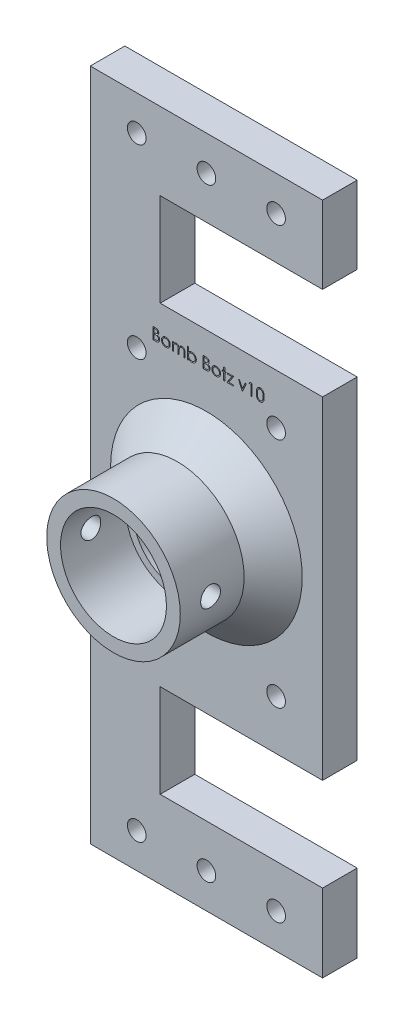
from build123d import *

# Parameters (mm, degrees)
BOSS_EXTRUDE1_DEPTH                     = 4.7625
BOSS_EXTRUDE1_DEPTH_BACK                = 4.699
SKETCH1_W                               = 63.5
SKETCH1_H                               = 184.15
SKETCH3_R                               = 6.35
CUT_EXTRUDE1_DEPTH                      = 0.508
SKETCH4_R                               = 18.25625
BOSS_EXTRUDE2_DEPTH                     = 38.1
SKETCH5_R                               = 12.461875
CUT_EXTRUDE2_DEPTH                      = 38.1
SKETCH7_R                               = 14.2875
CUT_EXTRUDE3_DEPTH                      = 30.48
F_10_CLEARANCE_HOLE1_D                  = 5.1054
SKETCH13_R                              = 14.478
CUT_EXTRUDE4_DEPTH                      = 30.48
CUT_EXTRUDE5_START                      = -12.7
SKETCH14_R                              = 18.25625
CUT_EXTRUDE5_DEPTH                      = 12.7
F_3_0_213_DIAMETER_HOLE1_D              = 5.4102
CBORE_FOR_M6_HEX_HEAD_BOLT1_D           = 7
CBORE_FOR_M6_HEX_HEAD_BOLT1_CBORE_D     = 14.55
CBORE_FOR_M6_HEX_HEAD_BOLT1_CBORE_DEPTH = 4.38
BOSS_EXTRUDE4_DEPTH                     = 1.27
CHAMFER1_SIZE                           = 7.9375
CUT_EXTRUDE6_DEPTH                      = 1.27
SKETCH30_W                              = 25.274131728
SKETCH30_H                              = 25.449688194
CUT_EXTRUDE7_DEPTH                      = 101.653008673
SKETCH31_W                              = 25.277922126
SKETCH31_H                              = 25.47783983
CUT_EXTRUDE8_DEPTH                      = 101.653008673
SKETCH32_W                              = 19.146423669
SKETCH32_H                              = 25.47783983
CUT_EXTRUDE10_DEPTH                     = 101.653008673
SKETCH33_W                              = 19.112951473
SKETCH33_H                              = 25.449688194
CUT_EXTRUDE11_DEPTH                     = 101.653008673


with BuildPart() as part:
    # Sketch1 → Boss-Extrude1 (new, two sides: drawn at the far end of the back side and taken through both)
    with BuildSketch(Plane.XY.offset(-BOSS_EXTRUDE1_DEPTH_BACK)):
        Rectangle(SKETCH1_W, SKETCH1_H)
    extrude(amount=BOSS_EXTRUDE1_DEPTH + BOSS_EXTRUDE1_DEPTH_BACK)

    # Sketch3 → Cut-Extrude1 (cut)
    with BuildSketch(Plane.XY.offset(4.7625)):
        Circle(SKETCH3_R)
    extrude(amount=-CUT_EXTRUDE1_DEPTH, mode=Mode.SUBTRACT)

    # Sketch4 → Boss-Extrude2 (add)
    with BuildSketch(Plane.XY.offset(4.7625)):
        with Locations(Location((0, 0, 0), (0, 0, 180))):
            Circle(SKETCH4_R)
    extrude(amount=BOSS_EXTRUDE2_DEPTH)

    # Sketch5 → Cut-Extrude2 (cut)
    with BuildSketch(Plane.XY.offset(42.8625)):
        Circle(SKETCH5_R)
    extrude(amount=-CUT_EXTRUDE2_DEPTH, mode=Mode.SUBTRACT)

    # Sketch7 → Cut-Extrude3 (cut)
    with BuildSketch(Plane.XY.offset(42.8625)):
        Circle(SKETCH7_R)
    extrude(amount=-CUT_EXTRUDE3_DEPTH, mode=Mode.SUBTRACT)

    # #10 Clearance Hole1 (through all)
    with Locations(Plane.XY.offset(4.7625)):
        with Locations((-19.05, 82.55), (-19.05, -82.55), (19.05, -82.55), (19.05, 82.55), (-19.05, 31.75), (-19.05, -31.75), (19.05, -31.75), (19.05, 31.75), (0, 82.55), (0, -82.55)):
            Hole(F_10_CLEARANCE_HOLE1_D / 2)

    # Sketch13 → Cut-Extrude4 (cut)
    with BuildSketch(Plane.XY.offset(42.8625)):
        Circle(SKETCH13_R)
    extrude(amount=-CUT_EXTRUDE4_DEPTH, mode=Mode.SUBTRACT)

    # Sketch14 → Cut-Extrude5 (cut)
    with BuildSketch(Plane.XY.offset(42.8625).offset(CUT_EXTRUDE5_START)):
        with Locations(Location((0, 0, 0), (0, 0, 180))):
            Circle(SKETCH14_R)
    extrude(amount=CUT_EXTRUDE5_DEPTH, mode=Mode.SUBTRACT)

    # #3 (0.213) Diameter Hole1 (through all)
    with Locations(Plane(origin=(18.25625, 0, 21.873504095), x_dir=(0, 1, 0), z_dir=(1, 0, 0))):
        with Locations((0, 0)):
            Hole(F_3_0_213_DIAMETER_HOLE1_D / 2)

    # CBORE for M6 Hex Head Bolt1 (through all)
    with Locations(Plane(origin=(0, 0, -4.699), x_dir=(-1, 0, 0), z_dir=(0, 0, -1))):
        with Locations((0, -58.039), (0, 58.039)):
            CounterBoreHole(CBORE_FOR_M6_HEX_HEAD_BOLT1_D / 2, CBORE_FOR_M6_HEX_HEAD_BOLT1_CBORE_D / 2, CBORE_FOR_M6_HEX_HEAD_BOLT1_CBORE_DEPTH)

    # Sketch28 → Boss-Extrude4 (add)
    # profile 1 of 11: a face of its own
    with BuildSketch(Plane.XY.offset(4.7625)):
        with BuildLine():
            Line((-15.150278343, 38.580814784), (-14.530797173, 38.580814784))
            add(Edge.make_bspline(
                [(-14.530797173, 38.580814784), (-14.500472768, 38.580655354), (-14.441696523, 38.580346337), (-14.35622603, 38.575553783), (-14.276171752, 38.569019025), (-14.201510472, 38.558650298), (-14.132276692, 38.546139186), (-14.068261764, 38.530988253), (-14.009669251, 38.512821253), (-13.939716983, 38.483932127), (-13.859960383, 38.441003253), (-13.773601841, 38.377568054), (-13.699756567, 38.299977891), (-13.636087551, 38.212454339), (-13.585467964, 38.116174032), (-13.548847244, 38.013431768), (-13.5256626, 37.905552759), (-13.523278235, 37.831490734), (-13.522073215, 37.794060978)],
                knots=[0, 0, 0, 0, 1.001505555, 1.941167018, 2.826882275, 3.653841531, 4.429895133, 5.150066043, 5.825578002, 6.45369114, 7.647487171, 8.808567382, 9.977351308, 11.170798116, 12.373658725, 13.556498008, 14.765093433, 16, 16, 16, 16], degree=3))
            add(Edge.make_bspline(
                [(-13.522073215, 37.794060978), (-13.52306492, 37.758997589), (-13.525013714, 37.690094721), (-13.543648932, 37.589316493), (-13.572823253, 37.493385031), (-13.6133773, 37.402650438), (-13.666084111, 37.319162803), (-13.728548443, 37.24224864), (-13.803910971, 37.175164467), (-13.860374481, 37.137660549), (-13.889055386, 37.118610257)],
                knots=[0, 0, 0, 0, 1.044552857, 2.05264487, 3.044412934, 4.028983338, 5.005914585, 5.980388656, 6.974128949, 8, 8, 8, 8], degree=3))
            add(Edge.make_bspline(
                [(-13.889055386, 37.118610257), (-13.852986998, 37.104762722), (-13.783979238, 37.078268958), (-13.689014069, 37.031428216), (-13.60719446, 36.980481159), (-13.537891334, 36.924844409), (-13.478620747, 36.864874273), (-13.426865579, 36.79969142), (-13.382704618, 36.728445546), (-13.344865038, 36.651879482), (-13.315338666, 36.570775043), (-13.293226238, 36.485892982), (-13.280555767, 36.397537671), (-13.278752692, 36.337407363), (-13.277842446, 36.307051764)],
                knots=[0, 0, 0, 0, 1.27268992, 2.434971085, 3.483601985, 4.442670788, 5.356604649, 6.2567628, 7.179492994, 8.113709626, 9.066344395, 10.018646069, 10.999752585, 12, 12, 12, 12], degree=3))
            add(Edge.make_bspline(
                [(-13.277842446, 36.307051764), (-13.278728584, 36.27605753), (-13.280472088, 36.215075506), (-13.293335348, 36.125490491), (-13.315115038, 36.039878932), (-13.345115292, 35.957687088), (-13.384269677, 35.879073966), (-13.431920045, 35.803950505), (-13.48873582, 35.733071505), (-13.552292851, 35.665649361), (-13.624194941, 35.605027011), (-13.701769947, 35.551037763), (-13.785994823, 35.506636693), (-13.875486274, 35.469338587), (-13.97124819, 35.440847772), (-14.072850555, 35.420915508), (-14.180205743, 35.407485225), (-14.253874589, 35.406381046), (-14.291654545, 35.405814784)],
                knots=[0, 0, 0, 0, 0.978564426, 1.925352924, 2.850884081, 3.763762016, 4.682927383, 5.618979971, 6.567305752, 7.547517671, 8.540179244, 9.531824382, 10.526200242, 11.540722885, 12.589160233, 13.674978461, 14.80764778, 16, 16, 16, 16], degree=3))
            Line((-14.291654545, 35.405814784), (-15.150278343, 35.405814784))
            Line((-15.150278343, 35.405814784), (-15.150278343, 38.580814784))
        make_face()
        with BuildLine():
            Line((-14.865342446, 38.255173759), (-14.865342446, 37.237545554))
            Line((-14.865342446, 37.237545554), (-14.673901139, 37.237545554))
            add(Edge.make_bspline(
                [(-14.673901139, 37.237545554), (-14.645916875, 37.237908341), (-14.591845573, 37.23860932), (-14.513541096, 37.240617296), (-14.440856258, 37.246239807), (-14.373916524, 37.251860702), (-14.312827307, 37.260999792), (-14.257723947, 37.271878361), (-14.207741648, 37.283383568), (-14.150102203, 37.302950173), (-14.084721743, 37.331867779), (-14.015023141, 37.376745802), (-13.953578301, 37.430198608), (-13.90169228, 37.491876123), (-13.859227589, 37.559790449), (-13.829733005, 37.632857976), (-13.809732968, 37.709257667), (-13.807926365, 37.761707082), (-13.807009112, 37.78833682)],
                knots=[0, 0, 0, 0, 1.156816544, 2.235205308, 3.236616184, 4.169592532, 5.011045266, 5.787822928, 6.49130361, 7.128639758, 8.301311294, 9.436451833, 10.541879658, 11.654887649, 12.756523258, 13.837046038, 14.901820046, 16, 16, 16, 16], degree=3))
            add(Edge.make_bspline(
                [(-13.807009112, 37.78833682), (-13.807486433, 37.80595877), (-13.808422749, 37.840526149), (-13.816091102, 37.890917348), (-13.829124545, 37.938309895), (-13.845865225, 37.983353267), (-13.86925925, 38.024639017), (-13.896803249, 38.06359463), (-13.930082411, 38.09889348), (-13.967962259, 38.131885811), (-14.011512938, 38.161136204), (-14.060708467, 38.186754611), (-14.116214431, 38.207383744), (-14.177095378, 38.225450539), (-14.244288436, 38.23813992), (-14.31701821, 38.248711207), (-14.395880419, 38.254093052), (-14.450440619, 38.254805488), (-14.478643728, 38.255173759)],
                knots=[0, 0, 0, 0, 0.91205012, 1.789085906, 2.630437955, 3.453916878, 4.269457761, 5.079663411, 5.91843418, 6.774407191, 7.675494373, 8.627863946, 9.638891023, 10.736472738, 11.911756761, 13.175263542, 14.539845004, 16, 16, 16, 16], degree=3))
            Line((-14.478643728, 38.255173759), (-14.865342446, 38.255173759))
        make_face(mode=Mode.SUBTRACT)
        with BuildLine():
            Line((-14.865342446, 36.911904528), (-14.865342446, 35.73145581))
            Line((-14.865342446, 35.73145581), (-14.459563199, 35.73145581))
            add(Edge.make_bspline(
                [(-14.459563199, 35.73145581), (-14.430517459, 35.731803924), (-14.374535624, 35.732474867), (-14.29370808, 35.734665213), (-14.218793407, 35.739647492), (-14.150133455, 35.747490512), (-14.08698683, 35.755998106), (-14.030111057, 35.767438339), (-13.979045089, 35.78054561), (-13.919831967, 35.800805895), (-13.853153784, 35.832280551), (-13.781298222, 35.879737028), (-13.717411581, 35.936273171), (-13.663159667, 36.001706215), (-13.618697885, 36.072854633), (-13.586353293, 36.148279343), (-13.566404445, 36.226734072), (-13.563989477, 36.280225304), (-13.562778343, 36.307051764)],
                knots=[0, 0, 0, 0, 1.160039823, 2.235823828, 3.228722157, 4.157150951, 4.99529583, 5.772374946, 6.472645482, 7.099169577, 8.269452708, 9.405989375, 10.527446681, 11.663510218, 12.788923519, 13.866172445, 14.929861265, 16, 16, 16, 16], degree=3))
            add(Edge.make_bspline(
                [(-13.562778343, 36.307051764), (-13.563028809, 36.323827865), (-13.563525701, 36.357109469), (-13.571019259, 36.406018819), (-13.581917555, 36.453395147), (-13.596006784, 36.499367097), (-13.616525872, 36.543103517), (-13.640480381, 36.585469411), (-13.668566795, 36.626520781), (-13.712331146, 36.678420468), (-13.77598716, 36.738216616), (-13.86643545, 36.79676135), (-13.96928032, 36.843976146), (-14.043872403, 36.864023528), (-14.082404745, 36.874379488)],
                knots=[0, 0, 0, 0, 0.723448775, 1.435228256, 2.130040452, 2.821711965, 3.505591119, 4.210454504, 4.921174351, 5.648778258, 7.137944449, 8.670945889, 10.280296675, 12, 12, 12, 12], degree=3))
            add(Edge.make_bspline(
                [(-14.082404745, 36.874379488), (-14.097852568, 36.877513743), (-14.131346634, 36.884309453), (-14.18596351, 36.89148287), (-14.248316763, 36.897873746), (-14.318550373, 36.90260101), (-14.3967532, 36.907487375), (-14.483092262, 36.909387677), (-14.577214969, 36.911654863), (-14.642522335, 36.911819177), (-14.67644521, 36.911904528)],
                knots=[0, 0, 0, 0, 0.634451884, 1.375622551, 2.216452059, 3.157844607, 4.20941857, 5.370758133, 6.634282058, 8, 8, 8, 8], degree=3))
            Line((-14.67644521, 36.911904528), (-14.865342446, 36.911904528))
        make_face(mode=Mode.SUBTRACT)
    # profile 2 of 11: a face of its own
    with BuildSketch(Plane.XY.offset(4.7625)):
        with BuildLine():
            add(Edge.make_bspline(
                [(-11.58730759, 37.76671222), (-11.543772649, 37.765785219), (-11.458411271, 37.763967596), (-11.333399831, 37.744541163), (-11.214069601, 37.714834625), (-11.099963555, 37.673766851), (-10.992543059, 37.618719653), (-10.89024343, 37.553034082), (-10.793345143, 37.475217015), (-10.73526711, 37.415020767), (-10.705787157, 37.384465626)],
                knots=[0, 0, 0, 0, 1.054011418, 2.066658804, 3.057071809, 4.030435133, 4.997543892, 5.974964718, 6.972108034, 8, 8, 8, 8], degree=3))
            add(Edge.make_bspline(
                [(-10.705787157, 37.384465626), (-10.680403527, 37.355242939), (-10.630127511, 37.297363104), (-10.565660752, 37.203514084), (-10.510124051, 37.106322707), (-10.465616936, 37.004498346), (-10.430524093, 36.898929894), (-10.405608783, 36.789254499), (-10.390788849, 36.675714369), (-10.388790443, 36.598603745), (-10.387778343, 36.559550762)],
                knots=[0, 0, 0, 0, 1.025258237, 2.030674902, 3.01204498, 3.988269485, 4.97094183, 5.956517959, 6.965070386, 8, 8, 8, 8], degree=3))
            add(Edge.make_bspline(
                [(-10.387778343, 36.559550762), (-10.388668556, 36.520271424), (-10.390427659, 36.44265362), (-10.407067939, 36.328336053), (-10.43294971, 36.217487892), (-10.46999002, 36.11057322), (-10.517486305, 36.007265226), (-10.575444286, 35.908015135), (-10.644270682, 35.812627129), (-10.722288593, 35.721911175), (-10.808514224, 35.638303252), (-10.902055301, 35.565434036), (-11.001073603, 35.503003082), (-11.106885788, 35.452714333), (-11.218525579, 35.413063391), (-11.336233777, 35.38521409), (-11.459827519, 35.368375991), (-11.544216499, 35.36621375), (-11.58730759, 35.365109656)],
                knots=[0, 0, 0, 0, 0.998656419, 1.973391657, 2.932242238, 3.890759089, 4.846373663, 5.82037756, 6.809684879, 7.83454468, 8.860553229, 9.859544525, 10.845671541, 11.83227036, 12.833544569, 13.85385346, 14.904124723, 16, 16, 16, 16], degree=3))
            add(Edge.make_bspline(
                [(-11.58730759, 35.365109656), (-11.6306098, 35.366217456), (-11.715419365, 35.368387137), (-11.839449363, 35.385148672), (-11.957368517, 35.413050556), (-12.06915446, 35.452844639), (-12.175421572, 35.503004689), (-12.275013608, 35.565245293), (-12.368630674, 35.638324863), (-12.454874546, 35.72190532), (-12.532887566, 35.812628637), (-12.601715224, 35.908014744), (-12.659672877, 36.007265328), (-12.707169248, 36.110573193), (-12.744209535, 36.217487899), (-12.770091312, 36.328336051), (-12.786731591, 36.442653621), (-12.788490694, 36.520271424), (-12.789380907, 36.559550762)],
                knots=[0, 0, 0, 0, 1.099876186, 2.154163076, 3.173186993, 4.173200201, 5.163417411, 6.152872554, 7.150605724, 8.17532212, 9.198891216, 10.186952605, 11.159729845, 12.11414092, 13.071450619, 14.029093627, 15.002601286, 16, 16, 16, 16], degree=3))
            add(Edge.make_bspline(
                [(-12.789380907, 36.559550762), (-12.788361904, 36.598391486), (-12.786344453, 36.675289444), (-12.77153942, 36.788616134), (-12.746721301, 36.898105909), (-12.711586391, 37.003266876), (-12.66666904, 37.104645022), (-12.611912728, 37.202076547), (-12.546788369, 37.295501195), (-12.496712313, 37.353306224), (-12.471372093, 37.382557573)],
                knots=[0, 0, 0, 0, 1.031353054, 2.041901799, 3.029428768, 4.008703097, 4.981709435, 5.96992636, 6.972712378, 8, 8, 8, 8], degree=3))
            add(Edge.make_bspline(
                [(-12.471372093, 37.382557573), (-12.441936585, 37.413377696), (-12.38404648, 37.473990892), (-12.286665849, 37.551581111), (-12.184617882, 37.618633549), (-12.076010271, 37.672586973), (-11.961997964, 37.7150762), (-11.842056223, 37.744617774), (-11.716620576, 37.763897603), (-11.630841492, 37.765764665), (-11.58730759, 37.76671222)],
                knots=[0, 0, 0, 0, 1.027980169, 2.021703884, 2.998553061, 3.971491411, 4.943284454, 5.930300938, 6.949603206, 8, 8, 8, 8], degree=3))
        make_face()
        with BuildLine():
            add(Edge.make_bspline(
                [(-11.588579625, 37.481776323), (-11.619365887, 37.4809013), (-11.680143668, 37.479173844), (-11.76960572, 37.466034873), (-11.855730002, 37.445218209), (-11.938679911, 37.415641672), (-12.018175717, 37.377451957), (-12.094293532, 37.330545087), (-12.167257245, 37.275542334), (-12.235639546, 37.212529767), (-12.298397786, 37.14369668), (-12.353259951, 37.070355668), (-12.399909869, 36.99369634), (-12.438772013, 36.913638977), (-12.46771639, 36.829372287), (-12.488737632, 36.741850572), (-12.501864208, 36.650895515), (-12.503575422, 36.589063734), (-12.50444501, 36.557642709)],
                knots=[0, 0, 0, 0, 1.021534396, 2.016698045, 2.994645724, 3.958388632, 4.93408049, 5.916473867, 6.921342795, 7.962252576, 8.998418191, 10.008913653, 10.997312074, 11.973003931, 12.956656626, 13.948281152, 14.957379055, 16, 16, 16, 16], degree=3))
            add(Edge.make_bspline(
                [(-12.50444501, 36.557642709), (-12.502987391, 36.517046227), (-12.500094291, 36.436469802), (-12.476567326, 36.317805427), (-12.437209772, 36.203884747), (-12.38406274, 36.095375597), (-12.317472813, 35.99498003), (-12.239016688, 35.905470898), (-12.149536389, 35.828195197), (-12.050098564, 35.764077573), (-11.942734289, 35.713132652), (-11.829108912, 35.677029295), (-11.71059914, 35.653559974), (-11.629608762, 35.65122728), (-11.588579625, 35.650045554)],
                knots=[0, 0, 0, 0, 1.016792936, 2.018143844, 3.017858371, 4.030088057, 5.03801393, 6.028138512, 7.003788237, 7.991172063, 8.984598303, 9.972568034, 10.972917682, 12, 12, 12, 12], degree=3))
            add(Edge.make_bspline(
                [(-11.588579625, 35.650045554), (-11.547552847, 35.651234165), (-11.466567128, 35.653580451), (-11.348222018, 35.676911095), (-11.234907201, 35.713290844), (-11.127654442, 35.764020277), (-11.02826188, 35.828438682), (-10.938138034, 35.905034538), (-10.860351794, 35.995217103), (-10.793827738, 36.095508576), (-10.739810336, 36.203716524), (-10.700637003, 36.317826452), (-10.677053479, 36.436464448), (-10.674168013, 36.517044433), (-10.67271424, 36.557642709)],
                knots=[0, 0, 0, 0, 1.02726834, 2.027799167, 3.010890988, 4.004497153, 4.992059811, 5.971914811, 6.958719428, 7.966827853, 8.981595046, 9.981490638, 10.983022906, 12, 12, 12, 12], degree=3))
            add(Edge.make_bspline(
                [(-10.67271424, 36.557642709), (-10.673583528, 36.589063922), (-10.675294154, 36.650896073), (-10.688425014, 36.741848441), (-10.709430397, 36.829380104), (-10.738433221, 36.913610135), (-10.777126505, 36.993903622), (-10.824676025, 37.070130588), (-10.879314169, 37.143950741), (-10.9428297, 37.212307258), (-11.011140621, 37.275566898), (-11.084133906, 37.330566416), (-11.160138851, 37.377245806), (-11.239403708, 37.415968324), (-11.322364252, 37.444949126), (-11.408367862, 37.46615507), (-11.497448211, 37.47911832), (-11.5580082, 37.480884655), (-11.588579625, 37.481776323)],
                knots=[0, 0, 0, 0, 1.042956736, 2.052379634, 3.044323526, 4.02829302, 5.004299113, 5.996692471, 7.007513377, 8.048758398, 9.090003419, 10.095195979, 11.07790575, 12.047570684, 13.018257071, 13.989683339, 14.985167495, 16, 16, 16, 16], degree=3))
        make_face(mode=Mode.SUBTRACT)
    # profile 3 of 11: a face of its own
    with BuildSketch(Plane.XY.offset(4.7625)):
        with BuildLine():
            Line((-9.817906548, 37.726007092), (-9.532970651, 37.726007092))
            Line((-9.532970651, 37.726007092), (-9.532970651, 37.322771916))
            add(Edge.make_bspline(
                [(-9.532970651, 37.322771916), (-9.507313068, 37.358048526), (-9.458150678, 37.425641893), (-9.377536837, 37.514714508), (-9.29700422, 37.590305048), (-9.23900751, 37.629986082), (-9.211145731, 37.649048959)],
                knots=[0, 0, 0, 0, 1.134379233, 2.173579362, 3.122582517, 4, 4, 4, 4], degree=3))
            add(Edge.make_bspline(
                [(-9.211145731, 37.649048959), (-9.173168502, 37.667196683), (-9.09787755, 37.70317507), (-8.978661538, 37.739672655), (-8.856673803, 37.762101854), (-8.77429778, 37.765169243), (-8.732860474, 37.76671222)],
                knots=[0, 0, 0, 0, 1.014936303, 2.012140481, 3.000054389, 4, 4, 4, 4], degree=3))
            add(Edge.make_bspline(
                [(-8.732860474, 37.76671222), (-8.704836113, 37.765763992), (-8.649377409, 37.7638875), (-8.567204699, 37.751677325), (-8.487504387, 37.730571583), (-8.410747375, 37.70117351), (-8.33842933, 37.665571158), (-8.272126986, 37.623797495), (-8.212596454, 37.576900862), (-8.159867822, 37.522763544), (-8.112452349, 37.459865344), (-8.068837967, 37.386509918), (-8.028537953, 37.301050112), (-8.006202908, 37.239031892), (-7.994444008, 37.20638069)],
                knots=[0, 0, 0, 0, 1.009824226, 1.998387844, 2.986035974, 3.974953746, 4.955485308, 5.885931332, 6.793869504, 7.679848016, 8.601185859, 9.625726857, 10.749998409, 12, 12, 12, 12], degree=3))
            add(Edge.make_bspline(
                [(-7.994444008, 37.20638069), (-7.982005944, 37.22880927), (-7.957529582, 37.272945567), (-7.916430897, 37.335409847), (-7.873370824, 37.393836009), (-7.827982391, 37.448270408), (-7.780425802, 37.498444235), (-7.730477246, 37.544523374), (-7.678421051, 37.586705711), (-7.606038091, 37.635984577), (-7.511865225, 37.688327791), (-7.393131007, 37.733710737), (-7.269623351, 37.761756082), (-7.185787296, 37.765049258), (-7.143452421, 37.76671222)],
                knots=[0, 0, 0, 0, 0.86119277, 1.694706429, 2.50939023, 3.298075842, 4.073795165, 4.829715201, 5.57930267, 6.321991688, 7.768977793, 9.186738141, 10.579381044, 12, 12, 12, 12], degree=3))
            add(Edge.make_bspline(
                [(-7.143452421, 37.76671222), (-7.104552809, 37.76524517), (-7.02842249, 37.76237401), (-6.917590256, 37.739828359), (-6.814228761, 37.701113636), (-6.718545985, 37.648287409), (-6.63222244, 37.581903436), (-6.557186931, 37.502919561), (-6.493895244, 37.411894468), (-6.452548907, 37.326267449), (-6.424504346, 37.250670397), (-6.407213083, 37.186257548), (-6.391937074, 37.115362925), (-6.379254087, 37.037901759), (-6.369984401, 36.953600421), (-6.36311668, 36.86259687), (-6.358468413, 36.764820375), (-6.358139962, 36.697360243), (-6.357970651, 36.662585618)],
                knots=[0, 0, 0, 0, 1.209669288, 2.367440248, 3.500751976, 4.631527125, 5.755587489, 6.87532382, 8.007944318, 9.190864318, 9.82315674, 10.514484317, 11.263564316, 12.079023757, 12.955305781, 13.901327259, 14.918167583, 16, 16, 16, 16], degree=3))
            Line((-6.357970651, 36.662585618), (-6.357970651, 35.405814784))
            Line((-6.357970651, 35.405814784), (-6.642906548, 35.405814784))
            Line((-6.642906548, 35.405814784), (-6.642906548, 36.663857653))
            add(Edge.make_bspline(
                [(-6.642906548, 36.663857653), (-6.642977199, 36.693539888), (-6.64311298, 36.750584629), (-6.645556488, 36.832456496), (-6.650160523, 36.907085648), (-6.655544088, 36.974370328), (-6.663022401, 37.034467444), (-6.672679782, 37.087256281), (-6.682910249, 37.133152095), (-6.699906469, 37.184030153), (-6.727073485, 37.240155272), (-6.768455056, 37.300683087), (-6.820588653, 37.35337067), (-6.880786795, 37.399107286), (-6.949320027, 37.436294375), (-7.024853026, 37.462851898), (-7.106916844, 37.479291938), (-7.163724659, 37.480930252), (-7.193061796, 37.481776323)],
                knots=[0, 0, 0, 0, 1.253487763, 2.409012846, 3.458416907, 4.410876679, 5.259312806, 6.014470957, 6.676830364, 7.243083969, 8.276244668, 9.299465089, 10.325150304, 11.392391894, 12.482080715, 13.603491619, 14.762376348, 16, 16, 16, 16], degree=3))
            add(Edge.make_bspline(
                [(-7.193061796, 37.481776323), (-7.229048112, 37.480491666), (-7.300170753, 37.477952695), (-7.403989158, 37.45203211), (-7.503748581, 37.412952169), (-7.596472308, 37.356317011), (-7.681768947, 37.288455138), (-7.755156421, 37.207765148), (-7.815782761, 37.116479428), (-7.856834582, 37.031982063), (-7.882769162, 36.956081924), (-7.899893222, 36.889772165), (-7.913213155, 36.814405315), (-7.925704993, 36.730487805), (-7.933858146, 36.637441999), (-7.941268026, 36.535698306), (-7.944734095, 36.424950714), (-7.945218925, 36.348182218), (-7.945470651, 36.308323799)],
                knots=[0, 0, 0, 0, 1.090531906, 2.155305635, 3.229839962, 4.33261226, 5.44038871, 6.529323825, 7.629011124, 8.757537029, 9.370236727, 10.061839251, 10.834451254, 11.692844982, 12.636905849, 13.66920014, 14.789842145, 16, 16, 16, 16], degree=3))
            Line((-7.945470651, 36.308323799), (-7.945470651, 35.405814784))
            Line((-7.945470651, 35.405814784), (-8.230406548, 35.405814784))
            Line((-8.230406548, 35.405814784), (-8.230406548, 36.585627485))
            add(Edge.make_bspline(
                [(-8.230406548, 36.585627485), (-8.230478603, 36.618913567), (-8.23061723, 36.682952643), (-8.233045033, 36.774786048), (-8.237659325, 36.858316743), (-8.242993822, 36.933447642), (-8.250668413, 37.000042204), (-8.25938584, 37.058457449), (-8.269680651, 37.10854693), (-8.286725761, 37.163486572), (-8.312773885, 37.224011981), (-8.354673237, 37.28854705), (-8.406931542, 37.34503311), (-8.46822798, 37.393255689), (-8.537175992, 37.43311689), (-8.613360934, 37.461836808), (-8.696096819, 37.478550271), (-8.753135881, 37.480680693), (-8.782469849, 37.481776323)],
                knots=[0, 0, 0, 0, 1.320475261, 2.540461679, 3.643808994, 4.639130445, 5.527981419, 6.302341397, 6.981980563, 7.553956391, 8.582137848, 9.585246428, 10.591171744, 11.620968678, 12.668337649, 13.738356861, 14.836885341, 16, 16, 16, 16], degree=3))
            add(Edge.make_bspline(
                [(-8.782469849, 37.481776323), (-8.816955984, 37.480387977), (-8.885685626, 37.477621053), (-8.986652413, 37.452716105), (-9.084157283, 37.413705265), (-9.176644759, 37.359585287), (-9.261620594, 37.292548265), (-9.336013808, 37.213704038), (-9.398554527, 37.124033844), (-9.440039817, 37.040427461), (-9.466799147, 36.966428847), (-9.484574915, 36.90351763), (-9.499850861, 36.833667405), (-9.511202866, 36.756662669), (-9.522161529, 36.673004962), (-9.527450452, 36.582277532), (-9.532595369, 36.48455821), (-9.532842488, 36.417091686), (-9.532970651, 36.382101844)],
                knots=[0, 0, 0, 0, 1.098833095, 2.189935336, 3.297829714, 4.440610912, 5.596351641, 6.740013378, 7.886572111, 9.072425424, 9.705826452, 10.395263256, 11.156850408, 11.985370555, 12.878090359, 13.847760091, 14.883794034, 16, 16, 16, 16], degree=3))
            Line((-9.532970651, 36.382101844), (-9.532970651, 35.405814784))
            Line((-9.532970651, 35.405814784), (-9.817906548, 35.405814784))
            Line((-9.817906548, 35.405814784), (-9.817906548, 37.726007092))
        make_face()
    # profile 4 of 11: a face of its own
    with BuildSketch(Plane.XY.offset(4.7625)):
        with BuildLine():
            Line((-5.706688599, 35.405814784), (-5.706688599, 38.662225041))
            Line((-5.706688599, 38.662225041), (-5.421752702, 38.662225041))
            Line((-5.421752702, 38.662225041), (-5.421752702, 37.304963422))
            add(Edge.make_bspline(
                [(-5.421752702, 37.304963422), (-5.389645815, 37.341936689), (-5.327003954, 37.414073057), (-5.221978173, 37.508277711), (-5.111845978, 37.588153886), (-4.99576956, 37.653999865), (-4.873583828, 37.704140923), (-4.745919701, 37.740809805), (-4.612450828, 37.76293221), (-4.521447006, 37.765441434), (-4.475358471, 37.76671222)],
                knots=[0, 0, 0, 0, 1.077089805, 2.101446609, 3.097517232, 4.067117542, 5.031729543, 5.997785507, 6.985986182, 8, 8, 8, 8], degree=3))
            add(Edge.make_bspline(
                [(-4.475358471, 37.76671222), (-4.434386332, 37.765587156), (-4.35337743, 37.763362713), (-4.234285768, 37.746458563), (-4.119701582, 37.7190467), (-4.009687245, 37.681044509), (-3.904756096, 37.630622808), (-3.804009666, 37.570260336), (-3.707964115, 37.498379852), (-3.618107184, 37.416194241), (-3.535290587, 37.326970733), (-3.462798524, 37.231557162), (-3.401566657, 37.131340473), (-3.350919698, 37.02665613), (-3.311757386, 36.917076583), (-3.284776901, 36.802709274), (-3.26763783, 36.683666715), (-3.265478606, 36.602647243), (-3.264380907, 36.561458815)],
                knots=[0, 0, 0, 0, 1.034377878, 2.045141349, 3.03070803, 4.00595497, 4.978199603, 5.965204761, 6.967410914, 8.002051993, 9.036360596, 10.037508045, 11.022711142, 11.997267194, 12.969246472, 13.954813154, 14.960274251, 16, 16, 16, 16], degree=3))
            add(Edge.make_bspline(
                [(-3.264380907, 36.561458815), (-3.265502535, 36.520909513), (-3.267714209, 36.440952676), (-3.284606396, 36.3232903), (-3.31249765, 36.210043766), (-3.352376724, 36.101505704), (-3.402509918, 35.997166211), (-3.465203718, 35.898214702), (-3.537603696, 35.802929345), (-3.621361238, 35.714370765), (-3.711997104, 35.632516181), (-3.808983596, 35.56139086), (-3.909877768, 35.499961758), (-4.016252162, 35.451288602), (-4.126531743, 35.411917767), (-4.241897987, 35.384596718), (-4.361698201, 35.368655447), (-4.443086049, 35.366300897), (-4.484262718, 35.365109656)],
                knots=[0, 0, 0, 0, 1.024244038, 2.01964794, 2.996620209, 3.965911562, 4.936179293, 5.91563013, 6.920572822, 7.955171681, 8.990768464, 10.002129126, 10.989675881, 11.969873457, 12.952483066, 13.943799762, 14.959703725, 16, 16, 16, 16], degree=3))
            add(Edge.make_bspline(
                [(-4.484262718, 35.365109656), (-4.531402498, 35.366416494), (-4.623835388, 35.368978974), (-4.759047449, 35.390223334), (-4.887028569, 35.426383509), (-5.009236631, 35.474971673), (-5.123924636, 35.540765523), (-5.231820736, 35.622369147), (-5.33224451, 35.721127192), (-5.391405478, 35.796475829), (-5.421752702, 35.835126684)],
                knots=[0, 0, 0, 0, 1.035807596, 2.031038093, 2.998900396, 3.954262848, 4.914341711, 5.895762244, 6.92060972, 8, 8, 8, 8], degree=3))
            Line((-5.421752702, 35.835126684), (-5.421752702, 35.405814784))
            Line((-5.421752702, 35.405814784), (-5.706688599, 35.405814784))
        make_face()
        with BuildLine():
            add(Edge.make_bspline(
                [(-4.486806788, 35.650045554), (-4.445155912, 35.651527488), (-4.362943705, 35.654452592), (-4.242253981, 35.677288664), (-4.126761805, 35.715283539), (-4.017049152, 35.767248046), (-3.914832919, 35.83258232), (-3.823526601, 35.911636347), (-3.742355722, 36.001898435), (-3.674635897, 36.103710428), (-3.618097089, 36.212069521), (-3.579259331, 36.326055923), (-3.553206441, 36.442619054), (-3.550618999, 36.521672965), (-3.549316804, 36.561458815)],
                knots=[0, 0, 0, 0, 1.031910345, 2.036826888, 3.032245421, 4.038315463, 5.03827337, 6.029480047, 7.023177075, 8.037597977, 9.052889626, 10.043399556, 11.015292101, 12, 12, 12, 12], degree=3))
            add(Edge.make_bspline(
                [(-3.549316804, 36.561458815), (-3.551029258, 36.601205771), (-3.554447328, 36.680541002), (-3.578373024, 36.798151772), (-3.620154019, 36.912077689), (-3.675596797, 37.022003435), (-3.744419898, 37.124517654), (-3.825161022, 37.216583698), (-3.917582375, 37.296013112), (-4.019929334, 37.362225534), (-4.128949935, 37.416254557), (-4.24369501, 37.45330683), (-4.361767021, 37.477562186), (-4.441954361, 37.480364467), (-4.482354665, 37.481776323)],
                knots=[0, 0, 0, 0, 0.984795267, 1.965658976, 2.959410029, 3.983795688, 5.009594896, 6.01088574, 7.009236619, 8.019050059, 9.024672985, 10.014834719, 10.999826153, 12, 12, 12, 12], degree=3))
            add(Edge.make_bspline(
                [(-4.482354665, 37.481776323), (-4.52360019, 37.480365265), (-4.605464187, 37.4775646), (-4.726266789, 37.453264217), (-4.844252767, 37.416028169), (-4.956999314, 37.362569017), (-5.062095493, 37.29715362), (-5.156086934, 37.220282154), (-5.237123419, 37.132488951), (-5.303838125, 37.034058688), (-5.356819621, 36.92775512), (-5.39472345, 36.814351193), (-5.417401701, 36.69444386), (-5.420284721, 36.612226594), (-5.421752702, 36.570363062)],
                knots=[0, 0, 0, 0, 1.016820015, 2.018181405, 3.029022337, 4.06341356, 5.088169224, 6.076823655, 7.05054209, 8.02560866, 9.001194327, 9.972267242, 10.967515442, 12, 12, 12, 12], degree=3))
            add(Edge.make_bspline(
                [(-5.421752702, 36.570363062), (-5.420882144, 36.538306612), (-5.41916861, 36.475209375), (-5.406078204, 36.38256497), (-5.385254139, 36.293907093), (-5.35591397, 36.209139133), (-5.317359278, 36.128742291), (-5.270904252, 36.052092276), (-5.215612401, 35.979880731), (-5.15310428, 35.91228469), (-5.084195549, 35.850771864), (-5.010242435, 35.797451617), (-4.932756169, 35.751537316), (-4.850850267, 35.71493878), (-4.765477882, 35.685069722), (-4.675762958, 35.66535411), (-4.582625309, 35.651769611), (-4.519082585, 35.65062629), (-4.486806788, 35.650045554)],
                knots=[0, 0, 0, 0, 1.050331198, 2.067384183, 3.060053655, 4.031335885, 5.001026174, 5.976994447, 6.963687968, 7.976578778, 8.990422448, 9.985569286, 10.960374351, 11.936812464, 12.921228065, 13.919088064, 14.943024695, 16, 16, 16, 16], degree=3))
        make_face(mode=Mode.SUBTRACT)
    # profile 5 of 11: a face of its own
    with BuildSketch(Plane.XY.offset(4.7625)):
        with BuildLine():
            Line((-1.39194501, 38.580814784), (-0.77246384, 38.580814784))
            add(Edge.make_bspline(
                [(-0.77246384, 38.580814784), (-0.742139435, 38.580655354), (-0.68336319, 38.580346337), (-0.597892697, 38.575553783), (-0.517838418, 38.569019025), (-0.443177139, 38.558650298), (-0.373943359, 38.546139186), (-0.309928431, 38.530988253), (-0.251335918, 38.512821253), (-0.18138365, 38.483932127), (-0.10162705, 38.441003253), (-0.015268508, 38.377568054), (0.058576766, 38.299977891), (0.122245783, 38.212454339), (0.17286537, 38.116174032), (0.209486089, 38.013431768), (0.232670733, 37.905552759), (0.235055099, 37.831490734), (0.236260119, 37.794060978)],
                knots=[0, 0, 0, 0, 1.001505555, 1.941167018, 2.826882275, 3.653841531, 4.429895133, 5.150066043, 5.825578002, 6.45369114, 7.647487171, 8.808567382, 9.977351308, 11.170798116, 12.373658725, 13.556498008, 14.765093433, 16, 16, 16, 16], degree=3))
            add(Edge.make_bspline(
                [(0.236260119, 37.794060978), (0.235268413, 37.758997589), (0.233319619, 37.690094721), (0.214684401, 37.589316493), (0.185510081, 37.493385031), (0.144956033, 37.402650438), (0.092249222, 37.319162803), (0.029784891, 37.24224864), (-0.045577637, 37.175164467), (-0.102041148, 37.137660549), (-0.130722053, 37.118610257)],
                knots=[0, 0, 0, 0, 1.044552857, 2.05264487, 3.044412934, 4.028983338, 5.005914585, 5.980388656, 6.974128949, 8, 8, 8, 8], degree=3))
            add(Edge.make_bspline(
                [(-0.130722053, 37.118610257), (-0.094653665, 37.104762722), (-0.025645904, 37.078268958), (0.069319264, 37.031428216), (0.151138874, 36.980481159), (0.220441999, 36.924844409), (0.279712586, 36.864874273), (0.331467754, 36.79969142), (0.375628715, 36.728445546), (0.413468296, 36.651879482), (0.442994667, 36.570775043), (0.465107095, 36.485892982), (0.477777567, 36.397537671), (0.479580641, 36.337407363), (0.480490888, 36.307051764)],
                knots=[0, 0, 0, 0, 1.27268992, 2.434971085, 3.483601985, 4.442670788, 5.356604649, 6.2567628, 7.179492994, 8.113709626, 9.066344395, 10.018646069, 10.999752585, 12, 12, 12, 12], degree=3))
            add(Edge.make_bspline(
                [(0.480490888, 36.307051764), (0.479604749, 36.27605753), (0.477861246, 36.215075506), (0.464997986, 36.125490491), (0.443218296, 36.039878932), (0.413218042, 35.957687088), (0.374063656, 35.879073966), (0.326413289, 35.803950505), (0.269597513, 35.733071505), (0.206040482, 35.665649361), (0.134138393, 35.605027011), (0.056563386, 35.551037763), (-0.027661489, 35.506636693), (-0.117152941, 35.469338587), (-0.212914856, 35.440847772), (-0.314517222, 35.420915508), (-0.42187241, 35.407485225), (-0.495541255, 35.406381046), (-0.533321212, 35.405814784)],
                knots=[0, 0, 0, 0, 0.978564426, 1.925352924, 2.850884081, 3.763762016, 4.682927383, 5.618979971, 6.567305752, 7.547517671, 8.540179244, 9.531824382, 10.526200242, 11.540722885, 12.589160233, 13.674978461, 14.80764778, 16, 16, 16, 16], degree=3))
            Line((-0.533321212, 35.405814784), (-1.39194501, 35.405814784))
            Line((-1.39194501, 35.405814784), (-1.39194501, 38.580814784))
        make_face()
        with BuildLine():
            Line((-1.107009112, 38.255173759), (-1.107009112, 37.237545554))
            Line((-1.107009112, 37.237545554), (-0.915567806, 37.237545554))
            add(Edge.make_bspline(
                [(-0.915567806, 37.237545554), (-0.887583542, 37.237908341), (-0.83351224, 37.23860932), (-0.755207763, 37.240617296), (-0.682522925, 37.246239807), (-0.61558319, 37.251860702), (-0.554493973, 37.260999792), (-0.499390613, 37.271878361), (-0.449408315, 37.283383568), (-0.39176887, 37.302950173), (-0.326388409, 37.331867779), (-0.256689808, 37.376745802), (-0.195244967, 37.430198608), (-0.143358947, 37.491876123), (-0.100894256, 37.559790449), (-0.071399672, 37.632857976), (-0.051399635, 37.709257667), (-0.049593032, 37.761707082), (-0.048675779, 37.78833682)],
                knots=[0, 0, 0, 0, 1.156816544, 2.235205308, 3.236616184, 4.169592532, 5.011045266, 5.787822928, 6.49130361, 7.128639758, 8.301311294, 9.436451833, 10.541879658, 11.654887649, 12.756523258, 13.837046038, 14.901820046, 16, 16, 16, 16], degree=3))
            add(Edge.make_bspline(
                [(-0.048675779, 37.78833682), (-0.049153099, 37.80595877), (-0.050089416, 37.840526149), (-0.057757769, 37.890917348), (-0.070791212, 37.938309895), (-0.087531892, 37.983353267), (-0.110925917, 38.024639017), (-0.138469915, 38.06359463), (-0.171749077, 38.09889348), (-0.209628925, 38.131885811), (-0.253179605, 38.161136204), (-0.302375134, 38.186754611), (-0.357881098, 38.207383744), (-0.418762045, 38.225450539), (-0.485955103, 38.23813992), (-0.558684876, 38.248711207), (-0.637547086, 38.254093052), (-0.692107286, 38.254805488), (-0.720310394, 38.255173759)],
                knots=[0, 0, 0, 0, 0.91205012, 1.789085906, 2.630437955, 3.453916878, 4.269457761, 5.079663411, 5.91843418, 6.774407191, 7.675494373, 8.627863946, 9.638891023, 10.736472738, 11.911756761, 13.175263542, 14.539845004, 16, 16, 16, 16], degree=3))
            Line((-0.720310394, 38.255173759), (-1.107009112, 38.255173759))
        make_face(mode=Mode.SUBTRACT)
        with BuildLine():
            Line((-1.107009112, 36.911904528), (-1.107009112, 35.73145581))
            Line((-1.107009112, 35.73145581), (-0.701229865, 35.73145581))
            add(Edge.make_bspline(
                [(-0.701229865, 35.73145581), (-0.672184125, 35.731803924), (-0.616202291, 35.732474867), (-0.535374746, 35.734665213), (-0.460460074, 35.739647492), (-0.391800122, 35.747490512), (-0.328653497, 35.755998106), (-0.271777724, 35.767438339), (-0.220711755, 35.78054561), (-0.161498633, 35.800805895), (-0.094820451, 35.832280551), (-0.022964888, 35.879737028), (0.040921753, 35.936273171), (0.095173666, 36.001706215), (0.139635449, 36.072854633), (0.17198004, 36.148279343), (0.191928889, 36.226734072), (0.194343857, 36.280225304), (0.19555499, 36.307051764)],
                knots=[0, 0, 0, 0, 1.160039823, 2.235823828, 3.228722157, 4.157150951, 4.99529583, 5.772374946, 6.472645482, 7.099169577, 8.269452708, 9.405989375, 10.527446681, 11.663510218, 12.788923519, 13.866172445, 14.929861265, 16, 16, 16, 16], degree=3))
            add(Edge.make_bspline(
                [(0.19555499, 36.307051764), (0.195304524, 36.323827865), (0.194807632, 36.357109469), (0.187314074, 36.406018819), (0.176415778, 36.453395147), (0.162326549, 36.499367097), (0.141807461, 36.543103517), (0.117852952, 36.585469411), (0.089766538, 36.626520781), (0.046002187, 36.678420468), (-0.017653827, 36.738216616), (-0.108102116, 36.79676135), (-0.210946987, 36.843976146), (-0.285539069, 36.864023528), (-0.324071412, 36.874379488)],
                knots=[0, 0, 0, 0, 0.723448775, 1.435228256, 2.130040452, 2.821711965, 3.505591119, 4.210454504, 4.921174351, 5.648778258, 7.137944449, 8.670945889, 10.280296675, 12, 12, 12, 12], degree=3))
            add(Edge.make_bspline(
                [(-0.324071412, 36.874379488), (-0.339519235, 36.877513743), (-0.3730133, 36.884309453), (-0.427630177, 36.89148287), (-0.489983429, 36.897873746), (-0.56021704, 36.90260101), (-0.638419867, 36.907487375), (-0.724758929, 36.909387677), (-0.818881636, 36.911654863), (-0.884189002, 36.911819177), (-0.918111877, 36.911904528)],
                knots=[0, 0, 0, 0, 0.634451884, 1.375622551, 2.216452059, 3.157844607, 4.20941857, 5.370758133, 6.634282058, 8, 8, 8, 8], degree=3))
            Line((-0.918111877, 36.911904528), (-1.107009112, 36.911904528))
        make_face(mode=Mode.SUBTRACT)
    # profile 6 of 11: a face of its own
    with BuildSketch(Plane.XY.offset(4.7625)):
        with BuildLine():
            add(Edge.make_bspline(
                [(2.171025744, 37.76671222), (2.214560684, 37.765785219), (2.299922063, 37.763967596), (2.424933502, 37.744541163), (2.544263732, 37.714834625), (2.658369778, 37.673766851), (2.765790275, 37.618719653), (2.868089903, 37.553034082), (2.96498819, 37.475217015), (3.023066224, 37.415020767), (3.052546176, 37.384465626)],
                knots=[0, 0, 0, 0, 1.054011418, 2.066658804, 3.057071809, 4.030435133, 4.997543892, 5.974964718, 6.972108034, 8, 8, 8, 8], degree=3))
            add(Edge.make_bspline(
                [(3.052546176, 37.384465626), (3.077929806, 37.355242939), (3.128205822, 37.297363104), (3.192672582, 37.203514084), (3.248209283, 37.106322707), (3.292716397, 37.004498346), (3.32780924, 36.898929894), (3.35272455, 36.789254499), (3.367544484, 36.675714369), (3.36954289, 36.598603745), (3.37055499, 36.559550762)],
                knots=[0, 0, 0, 0, 1.025258237, 2.030674902, 3.01204498, 3.988269485, 4.97094183, 5.956517959, 6.965070386, 8, 8, 8, 8], degree=3))
            add(Edge.make_bspline(
                [(3.37055499, 36.559550762), (3.369664777, 36.520271424), (3.367905675, 36.44265362), (3.351265394, 36.328336053), (3.325383623, 36.217487892), (3.288343313, 36.11057322), (3.240847028, 36.007265226), (3.182889047, 35.908015135), (3.114062652, 35.812627129), (3.03604474, 35.721911175), (2.94981911, 35.638303252), (2.856278032, 35.565434036), (2.75725973, 35.503003082), (2.651447546, 35.452714333), (2.539807754, 35.413063391), (2.422099556, 35.38521409), (2.298505814, 35.368375991), (2.214116835, 35.36621375), (2.171025744, 35.365109656)],
                knots=[0, 0, 0, 0, 0.998656419, 1.973391657, 2.932242238, 3.890759089, 4.846373663, 5.82037756, 6.809684879, 7.83454468, 8.860553229, 9.859544525, 10.845671541, 11.83227036, 12.833544569, 13.85385346, 14.904124723, 16, 16, 16, 16], degree=3))
            add(Edge.make_bspline(
                [(2.171025744, 35.365109656), (2.127723534, 35.366217456), (2.042913968, 35.368387137), (1.91888397, 35.385148672), (1.800964816, 35.413050556), (1.689178873, 35.452844639), (1.582911762, 35.503004689), (1.483319725, 35.565245293), (1.389702659, 35.638324863), (1.303458788, 35.72190532), (1.225445767, 35.812628637), (1.156618109, 35.908014744), (1.098660456, 36.007265328), (1.051164086, 36.110573193), (1.014123798, 36.217487899), (0.988242021, 36.328336051), (0.971601742, 36.442653621), (0.96984264, 36.520271424), (0.968952426, 36.559550762)],
                knots=[0, 0, 0, 0, 1.099876186, 2.154163076, 3.173186993, 4.173200201, 5.163417411, 6.152872554, 7.150605724, 8.17532212, 9.198891216, 10.186952605, 11.159729845, 12.11414092, 13.071450619, 14.029093627, 15.002601286, 16, 16, 16, 16], degree=3))
            add(Edge.make_bspline(
                [(0.968952426, 36.559550762), (0.969971429, 36.598391486), (0.97198888, 36.675289444), (0.986793913, 36.788616134), (1.011612032, 36.898105909), (1.046746942, 37.003266876), (1.091664294, 37.104645022), (1.146420605, 37.202076547), (1.211544964, 37.295501195), (1.26162102, 37.353306224), (1.28696124, 37.382557573)],
                knots=[0, 0, 0, 0, 1.031353054, 2.041901799, 3.029428768, 4.008703097, 4.981709435, 5.96992636, 6.972712378, 8, 8, 8, 8], degree=3))
            add(Edge.make_bspline(
                [(1.28696124, 37.382557573), (1.316396748, 37.413377696), (1.374286853, 37.473990892), (1.471667485, 37.551581111), (1.573715451, 37.618633549), (1.682323062, 37.672586973), (1.796335369, 37.7150762), (1.916277111, 37.744617774), (2.041712757, 37.763897603), (2.127491842, 37.765764665), (2.171025744, 37.76671222)],
                knots=[0, 0, 0, 0, 1.027980169, 2.021703884, 2.998553061, 3.971491411, 4.943284454, 5.930300938, 6.949603206, 8, 8, 8, 8], degree=3))
        make_face()
        with BuildLine():
            add(Edge.make_bspline(
                [(2.169753708, 37.481776323), (2.138967447, 37.4809013), (2.078189666, 37.479173844), (1.988727614, 37.466034873), (1.902603331, 37.445218209), (1.819653423, 37.415641672), (1.740157616, 37.377451957), (1.664039801, 37.330545087), (1.591076088, 37.275542334), (1.522693788, 37.212529767), (1.459935547, 37.14369668), (1.405073383, 37.070355668), (1.358423465, 36.99369634), (1.319561321, 36.913638977), (1.290616943, 36.829372287), (1.269595701, 36.741850572), (1.256469126, 36.650895515), (1.254757911, 36.589063734), (1.253888324, 36.557642709)],
                knots=[0, 0, 0, 0, 1.021534396, 2.016698045, 2.994645724, 3.958388632, 4.93408049, 5.916473867, 6.921342795, 7.962252576, 8.998418191, 10.008913653, 10.997312074, 11.973003931, 12.956656626, 13.948281152, 14.957379055, 16, 16, 16, 16], degree=3))
            add(Edge.make_bspline(
                [(1.253888324, 36.557642709), (1.255345942, 36.517046227), (1.258239043, 36.436469802), (1.281766007, 36.317805427), (1.321123561, 36.203884747), (1.374270593, 36.095375597), (1.44086052, 35.99498003), (1.519316645, 35.905470898), (1.608796945, 35.828195197), (1.70823477, 35.764077573), (1.815599044, 35.713132652), (1.929224421, 35.677029295), (2.047734193, 35.653559974), (2.128724571, 35.65122728), (2.169753708, 35.650045554)],
                knots=[0, 0, 0, 0, 1.016792936, 2.018143844, 3.017858371, 4.030088057, 5.03801393, 6.028138512, 7.003788237, 7.991172063, 8.984598303, 9.972568034, 10.972917682, 12, 12, 12, 12], degree=3))
            add(Edge.make_bspline(
                [(2.169753708, 35.650045554), (2.210780486, 35.651234165), (2.291766205, 35.653580451), (2.410111315, 35.676911095), (2.523426133, 35.713290844), (2.630678891, 35.764020277), (2.730071453, 35.828438682), (2.820195299, 35.905034538), (2.897981539, 35.995217103), (2.964505595, 36.095508576), (3.018522997, 36.203716524), (3.05769633, 36.317826452), (3.081279855, 36.436464448), (3.084165321, 36.517044433), (3.085619093, 36.557642709)],
                knots=[0, 0, 0, 0, 1.02726834, 2.027799167, 3.010890988, 4.004497153, 4.992059811, 5.971914811, 6.958719428, 7.966827853, 8.981595046, 9.981490638, 10.983022906, 12, 12, 12, 12], degree=3))
            add(Edge.make_bspline(
                [(3.085619093, 36.557642709), (3.084749805, 36.589063922), (3.083039179, 36.650896073), (3.069908319, 36.741848441), (3.048902936, 36.829380104), (3.019900112, 36.913610135), (2.981206828, 36.993903622), (2.933657309, 37.070130588), (2.879019164, 37.143950741), (2.815503633, 37.212307258), (2.747192712, 37.275566898), (2.674199427, 37.330566416), (2.598194482, 37.377245806), (2.518929625, 37.415968324), (2.435969082, 37.444949126), (2.349965472, 37.46615507), (2.260885123, 37.47911832), (2.200325134, 37.480884655), (2.169753708, 37.481776323)],
                knots=[0, 0, 0, 0, 1.042956736, 2.052379634, 3.044323526, 4.02829302, 5.004299113, 5.996692471, 7.007513377, 8.048758398, 9.090003419, 10.095195979, 11.07790575, 12.047570684, 13.018257071, 13.989683339, 14.985167495, 16, 16, 16, 16], degree=3))
        make_face(mode=Mode.SUBTRACT)
    # profile 7 of 11: a face of its own
    with BuildSketch(Plane.XY.offset(4.7625)):
        Polygon((4.225362683, 38.662225041), (4.51029858, 38.662225041), (4.51029858, 37.726007092), (4.917349862, 37.726007092), (4.917349862, 37.441071195), (4.51029858, 37.441071195), (4.51029858, 35.405814784), (4.225362683, 35.405814784), (4.225362683, 37.441071195), (3.818311401, 37.441071195), (3.818311401, 37.726007092), (4.225362683, 37.726007092), align=None)
    # profile 8 of 11: a face of its own
    with BuildSketch(Plane.XY.offset(4.7625)):
        Polygon((5.20228576, 37.726007092), (6.952606272, 37.726007092), (5.602976865, 35.690750682), (6.911901144, 35.690750682), (6.911901144, 35.405814784), (5.080170375, 35.405814784), (6.4304358, 37.441071195), (5.20228576, 37.441071195), align=None)
    # profile 9 of 11: a face of its own
    with BuildSketch(Plane.XY.offset(4.7625)):
        Polygon((8.255170375, 37.726007092), (8.563638925, 37.726007092), (9.333856272, 36.036744272), (10.10407362, 37.726007092), (10.41254217, 37.726007092), (9.354208837, 35.405814784), (9.313503708, 35.405814784), align=None)
    # profile 10 of 11: a face of its own
    with BuildSketch(Plane.XY.offset(4.7625)):
        Polygon((11.372292771, 38.580814784), (11.959337042, 38.580814784), (11.959337042, 35.405814784), (11.674401144, 35.405814784), (11.674401144, 38.255173759), (11.185939606, 38.255173759), align=None)
    # profile 11 of 11: a face of its own
    with BuildSketch(Plane.XY.offset(4.7625)):
        with BuildLine():
            add(Edge.make_bspline(
                [(13.13978576, 36.992042749), (13.140083319, 37.042931094), (13.140661332, 37.141782437), (13.147091543, 37.285822791), (13.15777346, 37.420951053), (13.172412363, 37.547173691), (13.190226816, 37.664523292), (13.214008008, 37.77268625), (13.241052479, 37.872163179), (13.272396483, 37.963278466), (13.307763977, 38.047259668), (13.346257914, 38.125659672), (13.389405977, 38.198359853), (13.434742177, 38.266520563), (13.484101699, 38.329026058), (13.536079888, 38.386759044), (13.592705447, 38.438385225), (13.652053461, 38.485417228), (13.714661254, 38.526646392), (13.778744244, 38.562961805), (13.844743519, 38.59398597), (13.91283927, 38.618379437), (13.982419448, 38.638527848), (14.053727287, 38.652306393), (14.126880524, 38.660975874), (14.176257612, 38.661804702), (14.201299181, 38.662225041)],
                knots=[0, 0, 0, 0, 1.646270934, 3.197905019, 4.663502075, 6.030701355, 7.308322542, 8.50163776, 9.611534131, 10.641858119, 11.616356847, 12.558055219, 13.465016945, 14.349605745, 15.204443733, 16.039544428, 16.859896111, 17.680448484, 18.487036065, 19.28249412, 20.06191084, 20.843045899, 21.620316918, 22.403196591, 23.190181807, 24, 24, 24, 24], degree=3))
            add(Edge.make_bspline(
                [(14.201299181, 38.662225041), (14.226549937, 38.661782523), (14.276765745, 38.660902494), (14.351006656, 38.652444346), (14.423532439, 38.638409827), (14.494033894, 38.618524371), (14.563090131, 38.593854008), (14.630161015, 38.562932123), (14.695663154, 38.526937722), (14.758555629, 38.484643204), (14.819528887, 38.437487854), (14.877085253, 38.384181719), (14.931229967, 38.325263045), (14.982642566, 38.261362211), (15.029864429, 38.191253598), (15.074834614, 38.116156584), (15.115086389, 38.034757871), (15.153852844, 37.94841559), (15.187314611, 37.854740699), (15.217491848, 37.754261238), (15.241874912, 37.645790369), (15.262185181, 37.529897203), (15.277919479, 37.406156129), (15.28937909, 37.2748324), (15.295432531, 37.135839617), (15.296572539, 37.040809282), (15.297157554, 36.992042749)],
                knots=[0, 0, 0, 0, 0.810914788, 1.612654377, 2.396697861, 3.181598691, 3.963628158, 4.749916497, 5.551656086, 6.361998678, 7.18212741, 8.025565596, 8.878627764, 9.750805457, 10.657531673, 11.591944965, 12.560506719, 13.57287815, 14.630710178, 15.753379473, 16.941251878, 18.199788006, 19.531962791, 20.947069417, 22.433333509, 24, 24, 24, 24], degree=3))
            add(Edge.make_bspline(
                [(15.297157554, 36.992042749), (15.296566474, 36.943488918), (15.295414778, 36.848883759), (15.289446952, 36.710516375), (15.277691622, 36.579889578), (15.262986847, 36.456690087), (15.242620616, 36.341430676), (15.217578787, 36.233712498), (15.189774565, 36.133070375), (15.155453002, 36.040328796), (15.117887572, 35.954194019), (15.077016073, 35.873760249), (15.033228445, 35.79831654), (14.98552294, 35.72846677), (14.934674487, 35.663716131), (14.879594778, 35.605207573), (14.821836462, 35.551531321), (14.76068377, 35.503768773), (14.696810435, 35.461963272), (14.631533272, 35.424576422), (14.56369406, 35.39442962), (14.494830167, 35.368544261), (14.423956578, 35.348768137), (14.351161638, 35.335093997), (14.276815624, 35.32550382), (14.22655849, 35.324772228), (14.201299181, 35.324404528)],
                knots=[0, 0, 0, 0, 1.561518951, 3.042555995, 4.452378317, 5.7783523, 7.031515105, 8.214008947, 9.334062868, 10.386615937, 11.391082383, 12.354592575, 13.286541444, 14.194233754, 15.072674879, 15.931287219, 16.775624067, 17.606195743, 18.42308326, 19.229000347, 20.022332153, 20.807536673, 21.593273796, 22.3848459, 23.188221202, 24, 24, 24, 24], degree=3))
            add(Edge.make_bspline(
                [(14.201299181, 35.324404528), (14.176258306, 35.324827579), (14.126882589, 35.325661753), (14.053719317, 35.334292067), (13.982705958, 35.348167273), (13.913492088, 35.367595193), (13.845722606, 35.391375794), (13.780320975, 35.422358064), (13.716560005, 35.458039684), (13.654609808, 35.498675531), (13.59563449, 35.545231629), (13.539302184, 35.596724948), (13.487028059, 35.654440471), (13.438374273, 35.717466873), (13.392133493, 35.785224314), (13.349598132, 35.858637909), (13.310254572, 35.937416563), (13.274292263, 36.022069239), (13.242407404, 36.11383121), (13.214242697, 36.21375225), (13.192004854, 36.322714291), (13.172970316, 36.439842189), (13.157617483, 36.565639254), (13.147136059, 36.700173782), (13.140657866, 36.843361935), (13.140081767, 36.941578088), (13.13978576, 36.992042749)],
                knots=[0, 0, 0, 0, 0.810891512, 1.598919785, 2.382837074, 3.152667961, 3.926044502, 4.706494248, 5.493654104, 6.291793342, 7.103789334, 7.925228297, 8.761435821, 9.622817696, 10.50288917, 11.416980706, 12.369136599, 13.353924996, 14.394355917, 15.514179734, 16.714354668, 17.994756427, 19.357759367, 20.818452758, 22.365282078, 24, 24, 24, 24], degree=3))
        make_face()
        with BuildLine():
            add(Edge.make_bspline(
                [(13.424721657, 36.993314784), (13.424830013, 36.950907036), (13.425040309, 36.868601924), (13.430534149, 36.749001252), (13.438018288, 36.637449596), (13.447671464, 36.533805317), (13.462006996, 36.438419234), (13.478069582, 36.350635307), (13.497616778, 36.270918099), (13.520744401, 36.198720585), (13.547087011, 36.132817502), (13.575848758, 36.071493542), (13.6067467, 36.014024286), (13.641326215, 35.960925941), (13.678986308, 35.912025349), (13.718876336, 35.866456994), (13.762485037, 35.825819733), (13.822813432, 35.7770818), (13.902457377, 35.726718014), (14.002805933, 35.682861204), (14.105919456, 35.655299976), (14.175906662, 35.651794997), (14.210839446, 35.650045554)],
                knots=[0, 0, 0, 0, 1.459021318, 2.831673884, 4.118529203, 5.306027144, 6.411944654, 7.436330062, 8.375795394, 9.233974572, 10.042671642, 10.816086306, 11.563610507, 12.285937304, 12.993564865, 13.685989202, 14.367179055, 15.041617293, 16.353048772, 17.594441528, 18.799311195, 20, 20, 20, 20], degree=3))
            add(Edge.make_bspline(
                [(14.210839446, 35.650045554), (14.245998191, 35.651494969), (14.316243091, 35.654390808), (14.418871605, 35.682329662), (14.51850335, 35.724484173), (14.596582896, 35.77432941), (14.655984917, 35.82179868), (14.69854533, 35.86227054), (14.73760876, 35.907587648), (14.774658356, 35.956482009), (14.808639089, 36.009887763), (14.839539221, 36.067548099), (14.867736258, 36.129623139), (14.883800892, 36.172957117), (14.892014325, 36.195112661)],
                knots=[0, 0, 0, 0, 1.353760809, 2.704726607, 4.075137775, 5.516104923, 6.260822281, 7.007110065, 7.778089737, 8.566572457, 9.372053459, 10.217411131, 11.088608312, 12, 12, 12, 12], degree=3))
            add(Edge.make_bspline(
                [(14.892014325, 36.195112661), (14.901586286, 36.223442496), (14.921021471, 36.280964211), (14.946069295, 36.370194095), (14.965795479, 36.463813745), (14.983542246, 36.561263673), (14.995655376, 36.663262544), (15.005405178, 36.769494764), (15.011148015, 36.880040428), (15.011859896, 36.955147313), (15.012221657, 36.993314784)],
                knots=[0, 0, 0, 0, 0.884706709, 1.796334032, 2.740027952, 3.714592787, 4.726048262, 5.777819803, 6.87074269, 8, 8, 8, 8], degree=3))
            add(Edge.make_bspline(
                [(15.012221657, 36.993314784), (15.011722557, 37.031476082), (15.01074621, 37.106127739), (15.007014236, 37.215454946), (14.997377136, 37.319293557), (14.986673649, 37.418090915), (14.970891885, 37.511300118), (14.953875874, 37.599701466), (14.931014774, 37.682199782), (14.906594693, 37.760086688), (14.878645262, 37.832477282), (14.847878846, 37.899709074), (14.815020537, 37.962106645), (14.779331504, 38.019498799), (14.74123542, 38.072142606), (14.699726786, 38.11898256), (14.656452105, 38.161470381), (14.595839372, 38.209968569), (14.516487695, 38.259418464), (14.417749144, 38.304925975), (14.314996488, 38.331059211), (14.245533426, 38.334743742), (14.210839446, 38.336584015)],
                knots=[0, 0, 0, 0, 1.31362396, 2.569729283, 3.763502607, 4.902122613, 5.988968491, 7.01645872, 7.998833611, 8.933434873, 9.825090667, 10.667526885, 11.477055099, 12.250526234, 12.991942729, 13.710640831, 14.402115721, 15.076753259, 16.378508321, 17.609869233, 18.806226677, 20, 20, 20, 20], degree=3))
            add(Edge.make_bspline(
                [(14.210839446, 38.336584015), (14.175723408, 38.334741203), (14.105427361, 38.331052221), (14.001606717, 38.305023341), (13.902089198, 38.259654436), (13.822947356, 38.209804784), (13.76229235, 38.162326459), (13.719581621, 38.121154461), (13.679534736, 38.076118216), (13.642643322, 38.026767908), (13.608090901, 37.973731467), (13.576358126, 37.916591659), (13.547767405, 37.855058922), (13.521383576, 37.789185441), (13.498185404, 37.716994156), (13.479050166, 37.63737514), (13.461372625, 37.549870424), (13.448858345, 37.453967727), (13.437733367, 37.350297488), (13.430583858, 37.23846735), (13.425021932, 37.11866609), (13.424823753, 37.035935425), (13.424721657, 36.993314784)],
                knots=[0, 0, 0, 0, 1.207732386, 2.417664972, 3.655092373, 4.956220595, 5.625982001, 6.301752483, 6.994047911, 7.697131622, 8.419323945, 9.170223765, 9.943494443, 10.752040957, 11.610060368, 12.549350801, 13.567764191, 14.679664412, 15.874934091, 17.154273443, 18.533957287, 20, 20, 20, 20], degree=3))
        make_face(mode=Mode.SUBTRACT)
    extrude(amount=-BOSS_EXTRUDE4_DEPTH)

    # Chamfer1
    chamfer1_edges = [part.edges().sort_by_distance(p)[0] for p in [
        (18.25625, 0, 4.7625),
    ]]
    chamfer(chamfer1_edges, length=CHAMFER1_SIZE)

    # Sketch29 → Cut-Extrude6 (cut)
    # profile 1 of 11: a face of its own
    with BuildSketch(Plane.XY.offset(4.7625)):
        with BuildLine():
            Line((-14.64676052, 39.024799241), (-14.02727935, 39.024799241))
            add(Edge.make_bspline(
                [(-14.02727935, 39.024799241), (-13.996954945, 39.02463981), (-13.938178701, 39.024330793), (-13.852708207, 39.019538239), (-13.772653929, 39.013003481), (-13.69799265, 39.002634754), (-13.62875887, 38.990123642), (-13.564743942, 38.974972709), (-13.506151428, 38.956805709), (-13.43619916, 38.927916583), (-13.356442561, 38.884987709), (-13.270084019, 38.82155251), (-13.196238744, 38.743962347), (-13.132569728, 38.656438796), (-13.081950141, 38.560158488), (-13.045329421, 38.457416224), (-13.022144777, 38.349537216), (-13.019760412, 38.27547519), (-13.018555392, 38.238045434)],
                knots=[0, 0, 0, 0, 1.001505555, 1.941167018, 2.826882275, 3.653841531, 4.429895133, 5.150066043, 5.825578002, 6.45369114, 7.647487171, 8.808567382, 9.977351308, 11.170798116, 12.373658725, 13.556498008, 14.765093433, 16, 16, 16, 16], degree=3))
            add(Edge.make_bspline(
                [(-13.018555392, 38.238045434), (-13.019547097, 38.202982045), (-13.021495892, 38.134079177), (-13.040131109, 38.033300949), (-13.06930543, 37.937369487), (-13.109859477, 37.846634894), (-13.162566288, 37.763147259), (-13.22503062, 37.686233097), (-13.300393148, 37.619148923), (-13.356856659, 37.581645005), (-13.385537564, 37.562594713)],
                knots=[0, 0, 0, 0, 1.044552857, 2.05264487, 3.044412934, 4.028983338, 5.005914585, 5.980388656, 6.974128949, 8, 8, 8, 8], degree=3))
            add(Edge.make_bspline(
                [(-13.385537564, 37.562594713), (-13.349469176, 37.548747179), (-13.280461415, 37.522253414), (-13.185496246, 37.475412672), (-13.103676637, 37.424465615), (-13.034373512, 37.368828865), (-12.975102925, 37.308858729), (-12.923347756, 37.243675876), (-12.879186795, 37.172430003), (-12.841347215, 37.095863938), (-12.811820843, 37.014759499), (-12.789708416, 36.929877438), (-12.777037944, 36.841522127), (-12.775234869, 36.781391819), (-12.774324623, 36.75103622)],
                knots=[0, 0, 0, 0, 1.27268992, 2.434971085, 3.483601985, 4.442670788, 5.356604649, 6.2567628, 7.179492994, 8.113709626, 9.066344395, 10.018646069, 10.999752585, 12, 12, 12, 12], degree=3))
            add(Edge.make_bspline(
                [(-12.774324623, 36.75103622), (-12.775210762, 36.720041986), (-12.776954265, 36.659059962), (-12.789817525, 36.569474947), (-12.811597215, 36.483863388), (-12.841597469, 36.401671544), (-12.880751854, 36.323058422), (-12.928402222, 36.247934961), (-12.985217998, 36.177055961), (-13.048775029, 36.109633817), (-13.120677118, 36.049011468), (-13.198252124, 35.995022219), (-13.282477, 35.950621149), (-13.371968452, 35.913323043), (-13.467730367, 35.884832228), (-13.569332732, 35.864899964), (-13.67668792, 35.851469681), (-13.750356766, 35.850365502), (-13.788136722, 35.849799241)],
                knots=[0, 0, 0, 0, 0.978564426, 1.925352924, 2.850884081, 3.763762016, 4.682927383, 5.618979971, 6.567305752, 7.547517671, 8.540179244, 9.531824382, 10.526200242, 11.540722885, 12.589160233, 13.674978461, 14.80764778, 16, 16, 16, 16], degree=3))
            Line((-13.788136722, 35.849799241), (-14.64676052, 35.849799241))
            Line((-14.64676052, 35.849799241), (-14.64676052, 39.024799241))
        make_face()
        with BuildLine():
            Line((-14.361824623, 38.699158215), (-14.361824623, 37.68153001))
            Line((-14.361824623, 37.68153001), (-14.170383317, 37.68153001))
            add(Edge.make_bspline(
                [(-14.170383317, 37.68153001), (-14.142399052, 37.681892797), (-14.088327751, 37.682593776), (-14.010023273, 37.684601752), (-13.937338435, 37.690224263), (-13.870398701, 37.695845158), (-13.809309484, 37.704984248), (-13.754206124, 37.715862817), (-13.704223825, 37.727368024), (-13.64658438, 37.74693463), (-13.58120392, 37.775852235), (-13.511505318, 37.820730258), (-13.450060478, 37.874183064), (-13.398174458, 37.935860579), (-13.355709767, 38.003774905), (-13.326215182, 38.076842432), (-13.306215146, 38.153242123), (-13.304408542, 38.205691538), (-13.303491289, 38.232321276)],
                knots=[0, 0, 0, 0, 1.156816544, 2.235205308, 3.236616184, 4.169592532, 5.011045266, 5.787822928, 6.49130361, 7.128639758, 8.301311294, 9.436451833, 10.541879658, 11.654887649, 12.756523258, 13.837046038, 14.901820046, 16, 16, 16, 16], degree=3))
            add(Edge.make_bspline(
                [(-13.303491289, 38.232321276), (-13.30396861, 38.249943226), (-13.304904927, 38.284510605), (-13.31257328, 38.334901805), (-13.325606722, 38.382294351), (-13.342347402, 38.427337723), (-13.365741427, 38.468623473), (-13.393285426, 38.507579086), (-13.426564588, 38.542877936), (-13.464444436, 38.575870267), (-13.507995115, 38.60512066), (-13.557190644, 38.630739067), (-13.612696608, 38.6513682), (-13.673577555, 38.669434995), (-13.740770613, 38.682124376), (-13.813500387, 38.692695663), (-13.892362596, 38.698077508), (-13.946922796, 38.698789944), (-13.975125905, 38.699158215)],
                knots=[0, 0, 0, 0, 0.91205012, 1.789085906, 2.630437955, 3.453916878, 4.269457761, 5.079663411, 5.91843418, 6.774407191, 7.675494373, 8.627863946, 9.638891023, 10.736472738, 11.911756761, 13.175263542, 14.539845004, 16, 16, 16, 16], degree=3))
            Line((-13.975125905, 38.699158215), (-14.361824623, 38.699158215))
        make_face(mode=Mode.SUBTRACT)
        with BuildLine():
            Line((-14.361824623, 37.355888984), (-14.361824623, 36.175440266))
            Line((-14.361824623, 36.175440266), (-13.956045376, 36.175440266))
            add(Edge.make_bspline(
                [(-13.956045376, 36.175440266), (-13.926999636, 36.17578838), (-13.871017802, 36.176459323), (-13.790190257, 36.178649669), (-13.715275584, 36.183631948), (-13.646615633, 36.191474969), (-13.583469008, 36.199982562), (-13.526593234, 36.211422795), (-13.475527266, 36.224530066), (-13.416314144, 36.244790351), (-13.349635961, 36.276265007), (-13.277780399, 36.323721484), (-13.213893758, 36.380257627), (-13.159641844, 36.445690671), (-13.115180062, 36.516839089), (-13.082835471, 36.592263799), (-13.062886622, 36.670718528), (-13.060471654, 36.72420976), (-13.05926052, 36.75103622)],
                knots=[0, 0, 0, 0, 1.160039823, 2.235823828, 3.228722157, 4.157150951, 4.99529583, 5.772374946, 6.472645482, 7.099169577, 8.269452708, 9.405989375, 10.527446681, 11.663510218, 12.788923519, 13.866172445, 14.929861265, 16, 16, 16, 16], degree=3))
            add(Edge.make_bspline(
                [(-13.05926052, 36.75103622), (-13.059510986, 36.767812321), (-13.060007878, 36.801093925), (-13.067501436, 36.850003275), (-13.078399732, 36.897379603), (-13.092488962, 36.943351553), (-13.11300805, 36.987087973), (-13.136962558, 37.029453867), (-13.165048973, 37.070505237), (-13.208813323, 37.122404924), (-13.272469338, 37.182201072), (-13.362917627, 37.240745806), (-13.465762497, 37.287960602), (-13.54035458, 37.308007985), (-13.578886923, 37.318363944)],
                knots=[0, 0, 0, 0, 0.723448775, 1.435228256, 2.130040452, 2.821711965, 3.505591119, 4.210454504, 4.921174351, 5.648778258, 7.137944449, 8.670945889, 10.280296675, 12, 12, 12, 12], degree=3))
            add(Edge.make_bspline(
                [(-13.578886923, 37.318363944), (-13.594334745, 37.321498199), (-13.627828811, 37.32829391), (-13.682445688, 37.335467326), (-13.74479894, 37.341858202), (-13.81503255, 37.346585466), (-13.893235377, 37.351471831), (-13.979574439, 37.353372133), (-14.073697146, 37.355639319), (-14.139004513, 37.355803634), (-14.172927387, 37.355888984)],
                knots=[0, 0, 0, 0, 0.634451884, 1.375622551, 2.216452059, 3.157844607, 4.20941857, 5.370758133, 6.634282058, 8, 8, 8, 8], degree=3))
            Line((-14.172927387, 37.355888984), (-14.361824623, 37.355888984))
        make_face(mode=Mode.SUBTRACT)
    # profile 2 of 11: a face of its own
    with BuildSketch(Plane.XY.offset(4.7625)):
        with BuildLine():
            add(Edge.make_bspline(
                [(-11.083789767, 38.210696676), (-11.040254827, 38.209769675), (-10.954893448, 38.207952052), (-10.829882009, 38.188525619), (-10.710551778, 38.158819081), (-10.596445733, 38.117751307), (-10.489025236, 38.062704109), (-10.386725607, 37.997018538), (-10.289827321, 37.919201471), (-10.231749287, 37.859005223), (-10.202269334, 37.828450082)],
                knots=[0, 0, 0, 0, 1.054011418, 2.066658804, 3.057071809, 4.030435133, 4.997543892, 5.974964718, 6.972108034, 8, 8, 8, 8], degree=3))
            add(Edge.make_bspline(
                [(-10.202269334, 37.828450082), (-10.176885705, 37.799227395), (-10.126609688, 37.74134756), (-10.062142929, 37.64749854), (-10.006606228, 37.550307163), (-9.962099113, 37.448482802), (-9.927006271, 37.34291435), (-9.90209096, 37.233238955), (-9.887271027, 37.119698825), (-9.885272621, 37.042588201), (-9.88426052, 37.003535218)],
                knots=[0, 0, 0, 0, 1.025258237, 2.030674902, 3.01204498, 3.988269485, 4.97094183, 5.956517959, 6.965070386, 8, 8, 8, 8], degree=3))
            add(Edge.make_bspline(
                [(-9.88426052, 37.003535218), (-9.885150733, 36.96425588), (-9.886909836, 36.886638076), (-9.903550117, 36.772320509), (-9.929431887, 36.661472348), (-9.966472198, 36.554557676), (-10.013968483, 36.451249683), (-10.071926463, 36.351999591), (-10.140752859, 36.256611585), (-10.21877077, 36.165895632), (-10.304996401, 36.082287708), (-10.398537478, 36.009418492), (-10.49755578, 35.946987538), (-10.603367965, 35.896698789), (-10.715007757, 35.857047847), (-10.832715954, 35.829198546), (-10.956309697, 35.812360448), (-11.040698676, 35.810198206), (-11.083789767, 35.809094112)],
                knots=[0, 0, 0, 0, 0.998656419, 1.973391657, 2.932242238, 3.890759089, 4.846373663, 5.82037756, 6.809684879, 7.83454468, 8.860553229, 9.859544525, 10.845671541, 11.83227036, 12.833544569, 13.85385346, 14.904124723, 16, 16, 16, 16], degree=3))
            add(Edge.make_bspline(
                [(-11.083789767, 35.809094112), (-11.127091977, 35.810201912), (-11.211901543, 35.812371593), (-11.33593154, 35.829133128), (-11.453850695, 35.857035012), (-11.565636638, 35.896829095), (-11.671903749, 35.946989145), (-11.771495785, 36.009229749), (-11.865112852, 36.082309319), (-11.951356723, 36.165889776), (-12.029369744, 36.256613093), (-12.098197401, 36.3519992), (-12.156155054, 36.451249785), (-12.203651425, 36.554557649), (-12.240691712, 36.661472355), (-12.266573489, 36.772320507), (-12.283213768, 36.886638077), (-12.284972871, 36.96425588), (-12.285863084, 37.003535218)],
                knots=[0, 0, 0, 0, 1.099876186, 2.154163076, 3.173186993, 4.173200201, 5.163417411, 6.152872554, 7.150605724, 8.17532212, 9.198891216, 10.186952605, 11.159729845, 12.11414092, 13.071450619, 14.029093627, 15.002601286, 16, 16, 16, 16], degree=3))
            add(Edge.make_bspline(
                [(-12.285863084, 37.003535218), (-12.284844081, 37.042375942), (-12.282826631, 37.1192739), (-12.268021597, 37.232600591), (-12.243203478, 37.342090365), (-12.208068569, 37.447251332), (-12.163151217, 37.548629478), (-12.108394906, 37.646061003), (-12.043270546, 37.739485651), (-11.99319449, 37.797290681), (-11.96785427, 37.826542029)],
                knots=[0, 0, 0, 0, 1.031353054, 2.041901799, 3.029428768, 4.008703097, 4.981709435, 5.96992636, 6.972712378, 8, 8, 8, 8], degree=3))
            add(Edge.make_bspline(
                [(-11.96785427, 37.826542029), (-11.938418763, 37.857362152), (-11.880528658, 37.917975348), (-11.783148026, 37.995565567), (-11.68110006, 38.062618005), (-11.572492448, 38.116571429), (-11.458480141, 38.159060656), (-11.3385384, 38.18860223), (-11.213102754, 38.207882059), (-11.127323669, 38.209749121), (-11.083789767, 38.210696676)],
                knots=[0, 0, 0, 0, 1.027980169, 2.021703884, 2.998553061, 3.971491411, 4.943284454, 5.930300938, 6.949603206, 8, 8, 8, 8], degree=3))
        make_face()
        with BuildLine():
            add(Edge.make_bspline(
                [(-11.085061802, 37.925760779), (-11.115848064, 37.924885757), (-11.176625845, 37.9231583), (-11.266087897, 37.91001933), (-11.352212179, 37.889202665), (-11.435162088, 37.859626128), (-11.514657894, 37.821436413), (-11.590775709, 37.774529543), (-11.663739423, 37.71952679), (-11.732121723, 37.656514224), (-11.794879963, 37.587681136), (-11.849742128, 37.514340124), (-11.896392046, 37.437680796), (-11.93525419, 37.357623433), (-11.964198568, 37.273356743), (-11.98521981, 37.185835028), (-11.998346385, 37.094879971), (-12.0000576, 37.033048191), (-12.000927187, 37.001627165)],
                knots=[0, 0, 0, 0, 1.021534396, 2.016698045, 2.994645724, 3.958388632, 4.93408049, 5.916473867, 6.921342795, 7.962252576, 8.998418191, 10.008913653, 10.997312074, 11.973003931, 12.956656626, 13.948281152, 14.957379055, 16, 16, 16, 16], degree=3))
            add(Edge.make_bspline(
                [(-12.000927187, 37.001627165), (-11.999469568, 36.961030683), (-11.996576468, 36.880454258), (-11.973049504, 36.761789883), (-11.93369195, 36.647869203), (-11.880544917, 36.539360053), (-11.81395499, 36.438964486), (-11.735498866, 36.349455354), (-11.646018566, 36.272179653), (-11.546580741, 36.208062029), (-11.439216467, 36.157117108), (-11.32559109, 36.121013752), (-11.207081317, 36.097544431), (-11.12609094, 36.095211736), (-11.085061802, 36.09403001)],
                knots=[0, 0, 0, 0, 1.016792936, 2.018143844, 3.017858371, 4.030088057, 5.03801393, 6.028138512, 7.003788237, 7.991172063, 8.984598303, 9.972568034, 10.972917682, 12, 12, 12, 12], degree=3))
            add(Edge.make_bspline(
                [(-11.085061802, 36.09403001), (-11.044035025, 36.095218621), (-10.963049306, 36.097564907), (-10.844704195, 36.120895551), (-10.731389378, 36.1572753), (-10.624136619, 36.208004733), (-10.524744057, 36.272423138), (-10.434620212, 36.349018994), (-10.356833972, 36.43920156), (-10.290309916, 36.539493032), (-10.236292513, 36.64770098), (-10.19711918, 36.761810909), (-10.173535656, 36.880448904), (-10.17065019, 36.961028889), (-10.169196418, 37.001627165)],
                knots=[0, 0, 0, 0, 1.02726834, 2.027799167, 3.010890988, 4.004497153, 4.992059811, 5.971914811, 6.958719428, 7.966827853, 8.981595046, 9.981490638, 10.983022906, 12, 12, 12, 12], degree=3))
            add(Edge.make_bspline(
                [(-10.169196418, 37.001627165), (-10.170065706, 37.033048378), (-10.171776331, 37.094880529), (-10.184907192, 37.185832897), (-10.205912574, 37.27336456), (-10.234915398, 37.357594592), (-10.273608682, 37.437888078), (-10.321158202, 37.514115044), (-10.375796346, 37.587935197), (-10.439311877, 37.656291714), (-10.507622799, 37.719551354), (-10.580616083, 37.774550872), (-10.656621028, 37.821230262), (-10.735885885, 37.85995278), (-10.818846429, 37.888933582), (-10.904850039, 37.910139526), (-10.993930388, 37.923102776), (-11.054490377, 37.924869111), (-11.085061802, 37.925760779)],
                knots=[0, 0, 0, 0, 1.042956736, 2.052379634, 3.044323526, 4.02829302, 5.004299113, 5.996692471, 7.007513377, 8.048758398, 9.090003419, 10.095195979, 11.07790575, 12.047570684, 13.018257071, 13.989683339, 14.985167495, 16, 16, 16, 16], degree=3))
        make_face(mode=Mode.SUBTRACT)
    # profile 3 of 11: a face of its own
    with BuildSketch(Plane.XY.offset(4.7625)):
        with BuildLine():
            Line((-9.314388725, 38.169991548), (-9.029452828, 38.169991548))
            Line((-9.029452828, 38.169991548), (-9.029452828, 37.766756372))
            add(Edge.make_bspline(
                [(-9.029452828, 37.766756372), (-9.003795245, 37.802032982), (-8.954632856, 37.869626349), (-8.874019014, 37.958698964), (-8.793486398, 38.034289504), (-8.735489687, 38.073970538), (-8.707627908, 38.093033415)],
                knots=[0, 0, 0, 0, 1.134379233, 2.173579362, 3.122582517, 4, 4, 4, 4], degree=3))
            add(Edge.make_bspline(
                [(-8.707627908, 38.093033415), (-8.669650679, 38.111181139), (-8.594359727, 38.147159526), (-8.475143716, 38.183657111), (-8.35315598, 38.206086311), (-8.270779957, 38.209153699), (-8.229342652, 38.210696676)],
                knots=[0, 0, 0, 0, 1.014936303, 2.012140481, 3.000054389, 4, 4, 4, 4], degree=3))
            add(Edge.make_bspline(
                [(-8.229342652, 38.210696676), (-8.201318291, 38.209748448), (-8.145859587, 38.207871956), (-8.063686876, 38.195661781), (-7.983986564, 38.174556039), (-7.907229552, 38.145157966), (-7.834911507, 38.109555614), (-7.768609163, 38.067781951), (-7.709078632, 38.020885318), (-7.656349999, 37.966748), (-7.608934526, 37.9038498), (-7.565320144, 37.830494374), (-7.52502013, 37.745034568), (-7.502685086, 37.683016348), (-7.490926185, 37.650365146)],
                knots=[0, 0, 0, 0, 1.009824226, 1.998387844, 2.986035974, 3.974953746, 4.955485308, 5.885931332, 6.793869504, 7.679848016, 8.601185859, 9.625726857, 10.749998409, 12, 12, 12, 12], degree=3))
            add(Edge.make_bspline(
                [(-7.490926185, 37.650365146), (-7.478488122, 37.672793726), (-7.454011759, 37.716930023), (-7.412913074, 37.779394303), (-7.369853001, 37.837820465), (-7.324464568, 37.892254864), (-7.276907979, 37.942428691), (-7.226959423, 37.98850783), (-7.174903228, 38.030690167), (-7.102520268, 38.079969033), (-7.008347403, 38.132312247), (-6.889613184, 38.177695193), (-6.766105529, 38.205740538), (-6.682269474, 38.209033714), (-6.639934599, 38.210696676)],
                knots=[0, 0, 0, 0, 0.86119277, 1.694706429, 2.50939023, 3.298075842, 4.073795165, 4.829715201, 5.57930267, 6.321991688, 7.768977793, 9.186738141, 10.579381044, 12, 12, 12, 12], degree=3))
            add(Edge.make_bspline(
                [(-6.639934599, 38.210696676), (-6.601034986, 38.209229626), (-6.524904667, 38.206358466), (-6.414072433, 38.183812815), (-6.310710938, 38.145098093), (-6.215028162, 38.092271865), (-6.128704617, 38.025887892), (-6.053669108, 37.946904018), (-5.990377421, 37.855878924), (-5.949031084, 37.770251906), (-5.920986523, 37.694654854), (-5.90369526, 37.630242004), (-5.888419251, 37.559347381), (-5.875736264, 37.481886215), (-5.866466578, 37.397584877), (-5.859598857, 37.306581326), (-5.854950591, 37.208804831), (-5.854622139, 37.141344699), (-5.854452828, 37.106570074)],
                knots=[0, 0, 0, 0, 1.209669288, 2.367440248, 3.500751976, 4.631527125, 5.755587489, 6.87532382, 8.007944318, 9.190864318, 9.82315674, 10.514484317, 11.263564316, 12.079023757, 12.955305781, 13.901327259, 14.918167583, 16, 16, 16, 16], degree=3))
            Line((-5.854452828, 37.106570074), (-5.854452828, 35.849799241))
            Line((-5.854452828, 35.849799241), (-6.139388725, 35.849799241))
            Line((-6.139388725, 35.849799241), (-6.139388725, 37.107842109))
            add(Edge.make_bspline(
                [(-6.139388725, 37.107842109), (-6.139459376, 37.137524344), (-6.139595157, 37.194569085), (-6.142038665, 37.276440952), (-6.1466427, 37.351070105), (-6.152026266, 37.418354784), (-6.159504578, 37.4784519), (-6.169161959, 37.531240737), (-6.179392426, 37.577136551), (-6.196388647, 37.628014609), (-6.223555662, 37.684139728), (-6.264937234, 37.744667543), (-6.31707083, 37.797355126), (-6.377268972, 37.843091742), (-6.445802204, 37.880278831), (-6.521335203, 37.906836354), (-6.603399021, 37.923276394), (-6.660206836, 37.924914708), (-6.689543974, 37.925760779)],
                knots=[0, 0, 0, 0, 1.253487763, 2.409012846, 3.458416907, 4.410876679, 5.259312806, 6.014470957, 6.676830364, 7.243083969, 8.276244668, 9.299465089, 10.325150304, 11.392391894, 12.482080715, 13.603491619, 14.762376348, 16, 16, 16, 16], degree=3))
            add(Edge.make_bspline(
                [(-6.689543974, 37.925760779), (-6.72553029, 37.924476122), (-6.79665293, 37.921937151), (-6.900471336, 37.896016566), (-7.000230758, 37.856936625), (-7.092954486, 37.800301467), (-7.178251124, 37.732439594), (-7.251638598, 37.651749604), (-7.312264938, 37.560463884), (-7.353316759, 37.475966519), (-7.37925134, 37.40006638), (-7.396375399, 37.333756622), (-7.409695333, 37.258389771), (-7.42218717, 37.174472261), (-7.430340323, 37.081426455), (-7.437750204, 36.979682762), (-7.441216272, 36.868935171), (-7.441701103, 36.792166674), (-7.441952828, 36.752308255)],
                knots=[0, 0, 0, 0, 1.090531906, 2.155305635, 3.229839962, 4.33261226, 5.44038871, 6.529323825, 7.629011124, 8.757537029, 9.370236727, 10.061839251, 10.834451254, 11.692844982, 12.636905849, 13.66920014, 14.789842145, 16, 16, 16, 16], degree=3))
            Line((-7.441952828, 36.752308255), (-7.441952828, 35.849799241))
            Line((-7.441952828, 35.849799241), (-7.726888725, 35.849799241))
            Line((-7.726888725, 35.849799241), (-7.726888725, 37.029611941))
            add(Edge.make_bspline(
                [(-7.726888725, 37.029611941), (-7.726960781, 37.062898023), (-7.727099408, 37.126937099), (-7.72952721, 37.218770505), (-7.734141502, 37.302301199), (-7.739476, 37.377432098), (-7.74715059, 37.44402666), (-7.755868017, 37.502441905), (-7.766162828, 37.552531387), (-7.783207938, 37.607471029), (-7.809256063, 37.667996437), (-7.851155415, 37.732531506), (-7.90341372, 37.789017566), (-7.964710157, 37.837240145), (-8.033658169, 37.877101346), (-8.109843111, 37.905821264), (-8.192578996, 37.922534727), (-8.249618058, 37.924665149), (-8.278952027, 37.925760779)],
                knots=[0, 0, 0, 0, 1.320475261, 2.540461679, 3.643808994, 4.639130445, 5.527981419, 6.302341397, 6.981980563, 7.553956391, 8.582137848, 9.585246428, 10.591171744, 11.620968678, 12.668337649, 13.738356861, 14.836885341, 16, 16, 16, 16], degree=3))
            add(Edge.make_bspline(
                [(-8.278952027, 37.925760779), (-8.313438161, 37.924372433), (-8.382167803, 37.921605509), (-8.48313459, 37.896700561), (-8.58063946, 37.857689721), (-8.673126937, 37.803569743), (-8.758102771, 37.736532721), (-8.832495985, 37.657688495), (-8.895036705, 37.5680183), (-8.936521994, 37.484411917), (-8.963281324, 37.410413303), (-8.981057092, 37.347502087), (-8.996333038, 37.277651861), (-9.007685044, 37.200647125), (-9.018643706, 37.116989418), (-9.02393263, 37.026261988), (-9.029077547, 36.928542666), (-9.029324666, 36.861076142), (-9.029452828, 36.8260863)],
                knots=[0, 0, 0, 0, 1.098833095, 2.189935336, 3.297829714, 4.440610912, 5.596351641, 6.740013378, 7.886572111, 9.072425424, 9.705826452, 10.395263256, 11.156850408, 11.985370555, 12.878090359, 13.847760091, 14.883794034, 16, 16, 16, 16], degree=3))
            Line((-9.029452828, 36.8260863), (-9.029452828, 35.849799241))
            Line((-9.029452828, 35.849799241), (-9.314388725, 35.849799241))
            Line((-9.314388725, 35.849799241), (-9.314388725, 38.169991548))
        make_face()
    # profile 4 of 11: a face of its own
    with BuildSketch(Plane.XY.offset(4.7625)):
        with BuildLine():
            Line((-5.203170777, 35.849799241), (-5.203170777, 39.106209497))
            Line((-5.203170777, 39.106209497), (-4.918234879, 39.106209497))
            Line((-4.918234879, 39.106209497), (-4.918234879, 37.748947878))
            add(Edge.make_bspline(
                [(-4.918234879, 37.748947878), (-4.886127992, 37.785921145), (-4.823486132, 37.858057513), (-4.718460351, 37.952262167), (-4.608328155, 38.032138342), (-4.492251738, 38.097984321), (-4.370066006, 38.148125379), (-4.242401878, 38.184794261), (-4.108933006, 38.206916666), (-4.017929184, 38.20942589), (-3.971840648, 38.210696676)],
                knots=[0, 0, 0, 0, 1.077089805, 2.101446609, 3.097517232, 4.067117542, 5.031729543, 5.997785507, 6.985986182, 8, 8, 8, 8], degree=3))
            add(Edge.make_bspline(
                [(-3.971840648, 38.210696676), (-3.930868509, 38.209571612), (-3.849859607, 38.207347169), (-3.730767945, 38.190443019), (-3.61618376, 38.163031156), (-3.506169422, 38.125028965), (-3.401238273, 38.074607264), (-3.300491843, 38.014244792), (-3.204446293, 37.942364308), (-3.114589361, 37.860178697), (-3.031772764, 37.77095519), (-2.959280701, 37.675541618), (-2.898048834, 37.575324929), (-2.847401876, 37.470640586), (-2.808239564, 37.361061039), (-2.781259078, 37.246693731), (-2.764120007, 37.127651171), (-2.761960784, 37.046631699), (-2.760863084, 37.005443271)],
                knots=[0, 0, 0, 0, 1.034377878, 2.045141349, 3.03070803, 4.00595497, 4.978199603, 5.965204761, 6.967410914, 8.002051993, 9.036360596, 10.037508045, 11.022711142, 11.997267194, 12.969246472, 13.954813154, 14.960274251, 16, 16, 16, 16], degree=3))
            add(Edge.make_bspline(
                [(-2.760863084, 37.005443271), (-2.761984713, 36.964893969), (-2.764196387, 36.884937132), (-2.781088573, 36.767274756), (-2.808979828, 36.654028222), (-2.848858901, 36.54549016), (-2.898992096, 36.441150667), (-2.961685896, 36.342199158), (-3.034085874, 36.246913801), (-3.117843416, 36.158355221), (-3.208479281, 36.076500637), (-3.305465773, 36.005375316), (-3.406359945, 35.943946215), (-3.51273434, 35.895273058), (-3.62301392, 35.855902223), (-3.738380164, 35.828581175), (-3.858180378, 35.812639903), (-3.939568227, 35.810285353), (-3.980744895, 35.809094112)],
                knots=[0, 0, 0, 0, 1.024244038, 2.01964794, 2.996620209, 3.965911562, 4.936179293, 5.91563013, 6.920572822, 7.955171681, 8.990768464, 10.002129126, 10.989675881, 11.969873457, 12.952483066, 13.943799762, 14.959703725, 16, 16, 16, 16], degree=3))
            add(Edge.make_bspline(
                [(-3.980744895, 35.809094112), (-4.027884676, 35.81040095), (-4.120317566, 35.81296343), (-4.255529626, 35.83420779), (-4.383510746, 35.870367965), (-4.505718808, 35.918956129), (-4.620406814, 35.98474998), (-4.728302914, 36.066353603), (-4.828726687, 36.165111648), (-4.887887655, 36.240460285), (-4.918234879, 36.27911114)],
                knots=[0, 0, 0, 0, 1.035807596, 2.031038093, 2.998900396, 3.954262848, 4.914341711, 5.895762244, 6.92060972, 8, 8, 8, 8], degree=3))
            Line((-4.918234879, 36.27911114), (-4.918234879, 35.849799241))
            Line((-4.918234879, 35.849799241), (-5.203170777, 35.849799241))
        make_face()
        with BuildLine():
            add(Edge.make_bspline(
                [(-3.983288966, 36.09403001), (-3.941638089, 36.095511945), (-3.859425883, 36.098437048), (-3.738736159, 36.12127312), (-3.623243983, 36.159267995), (-3.51353133, 36.211232502), (-3.411315097, 36.276566776), (-3.320008779, 36.355620803), (-3.238837899, 36.445882891), (-3.171118074, 36.547694884), (-3.114579266, 36.656053978), (-3.075741509, 36.770040379), (-3.049688619, 36.88660351), (-3.047101176, 36.965657421), (-3.045798982, 37.005443271)],
                knots=[0, 0, 0, 0, 1.031910345, 2.036826888, 3.032245421, 4.038315463, 5.03827337, 6.029480047, 7.023177075, 8.037597977, 9.052889626, 10.043399556, 11.015292101, 12, 12, 12, 12], degree=3))
            add(Edge.make_bspline(
                [(-3.045798982, 37.005443271), (-3.047511435, 37.045190227), (-3.050929505, 37.124525459), (-3.074855201, 37.242136228), (-3.116636196, 37.356062145), (-3.172078974, 37.465987891), (-3.240902075, 37.56850211), (-3.321643199, 37.660568154), (-3.414064552, 37.739997569), (-3.516411511, 37.80620999), (-3.625432113, 37.860239013), (-3.740177187, 37.897291286), (-3.858249199, 37.921546642), (-3.938436539, 37.924348923), (-3.978836842, 37.925760779)],
                knots=[0, 0, 0, 0, 0.984795267, 1.965658976, 2.959410029, 3.983795688, 5.009594896, 6.01088574, 7.009236619, 8.019050059, 9.024672985, 10.014834719, 10.999826153, 12, 12, 12, 12], degree=3))
            add(Edge.make_bspline(
                [(-3.978836842, 37.925760779), (-4.020082367, 37.924349721), (-4.101946364, 37.921549056), (-4.222748966, 37.897248673), (-4.340734945, 37.860012625), (-4.453481491, 37.806553473), (-4.55857767, 37.741138076), (-4.652569111, 37.66426661), (-4.733605596, 37.576473407), (-4.800320302, 37.478043144), (-4.853301798, 37.371739576), (-4.891205627, 37.258335649), (-4.913883878, 37.138428316), (-4.916766898, 37.056211051), (-4.918234879, 37.014347518)],
                knots=[0, 0, 0, 0, 1.016820015, 2.018181405, 3.029022337, 4.06341356, 5.088169224, 6.076823655, 7.05054209, 8.02560866, 9.001194327, 9.972267242, 10.967515442, 12, 12, 12, 12], degree=3))
            add(Edge.make_bspline(
                [(-4.918234879, 37.014347518), (-4.917364321, 36.982291068), (-4.915650787, 36.919193831), (-4.902560381, 36.826549426), (-4.881736317, 36.737891549), (-4.852396147, 36.653123589), (-4.813841456, 36.572726747), (-4.767386429, 36.496076732), (-4.712094578, 36.423865187), (-4.649586458, 36.356269146), (-4.580677727, 36.29475632), (-4.506724612, 36.241436073), (-4.429238346, 36.195521772), (-4.347332444, 36.158923236), (-4.261960059, 36.129054178), (-4.172245135, 36.109338566), (-4.079107486, 36.095754067), (-4.015564762, 36.094610746), (-3.983288966, 36.09403001)],
                knots=[0, 0, 0, 0, 1.050331198, 2.067384183, 3.060053655, 4.031335885, 5.001026174, 5.976994447, 6.963687968, 7.976578778, 8.990422448, 9.985569286, 10.960374351, 11.936812464, 12.921228065, 13.919088064, 14.943024695, 16, 16, 16, 16], degree=3))
        make_face(mode=Mode.SUBTRACT)
    # profile 5 of 11: a face of its own
    with BuildSketch(Plane.XY.offset(4.7625)):
        with BuildLine():
            Line((-0.888427187, 39.024799241), (-0.268946017, 39.024799241))
            add(Edge.make_bspline(
                [(-0.268946017, 39.024799241), (-0.238621612, 39.02463981), (-0.179845367, 39.024330793), (-0.094374874, 39.019538239), (-0.014320596, 39.013003481), (0.060340684, 39.002634754), (0.129574464, 38.990123642), (0.193589392, 38.974972709), (0.252181905, 38.956805709), (0.322134173, 38.927916583), (0.401890773, 38.884987709), (0.488249315, 38.82155251), (0.562094589, 38.743962347), (0.625763605, 38.656438796), (0.676383192, 38.560158488), (0.713003912, 38.457416224), (0.736188556, 38.349537216), (0.738572921, 38.27547519), (0.739777941, 38.238045434)],
                knots=[0, 0, 0, 0, 1.001505555, 1.941167018, 2.826882275, 3.653841531, 4.429895133, 5.150066043, 5.825578002, 6.45369114, 7.647487171, 8.808567382, 9.977351308, 11.170798116, 12.373658725, 13.556498008, 14.765093433, 16, 16, 16, 16], degree=3))
            add(Edge.make_bspline(
                [(0.739777941, 38.238045434), (0.738786236, 38.202982045), (0.736837442, 38.134079177), (0.718202224, 38.033300949), (0.689027903, 37.937369487), (0.648473856, 37.846634894), (0.595767045, 37.763147259), (0.533302713, 37.686233097), (0.457940185, 37.619148923), (0.401476675, 37.581645005), (0.37279577, 37.562594713)],
                knots=[0, 0, 0, 0, 1.044552857, 2.05264487, 3.044412934, 4.028983338, 5.005914585, 5.980388656, 6.974128949, 8, 8, 8, 8], degree=3))
            add(Edge.make_bspline(
                [(0.37279577, 37.562594713), (0.408864158, 37.548747179), (0.477871919, 37.522253414), (0.572837087, 37.475412672), (0.654656696, 37.424465615), (0.723959822, 37.368828865), (0.783230409, 37.308858729), (0.834985577, 37.243675876), (0.879146538, 37.172430003), (0.916986119, 37.095863938), (0.94651249, 37.014759499), (0.968624918, 36.929877438), (0.981295389, 36.841522127), (0.983098464, 36.781391819), (0.984008711, 36.75103622)],
                knots=[0, 0, 0, 0, 1.27268992, 2.434971085, 3.483601985, 4.442670788, 5.356604649, 6.2567628, 7.179492994, 8.113709626, 9.066344395, 10.018646069, 10.999752585, 12, 12, 12, 12], degree=3))
            add(Edge.make_bspline(
                [(0.984008711, 36.75103622), (0.983122572, 36.720041986), (0.981379069, 36.659059962), (0.968515808, 36.569474947), (0.946736118, 36.483863388), (0.916735864, 36.401671544), (0.877581479, 36.323058422), (0.829931111, 36.247934961), (0.773115336, 36.177055961), (0.709558305, 36.109633817), (0.637656215, 36.049011468), (0.560081209, 35.995022219), (0.475856333, 35.950621149), (0.386364882, 35.913323043), (0.290602966, 35.884832228), (0.189000601, 35.864899964), (0.081645413, 35.851469681), (0.007976567, 35.850365502), (-0.029803389, 35.849799241)],
                knots=[0, 0, 0, 0, 0.978564426, 1.925352924, 2.850884081, 3.763762016, 4.682927383, 5.618979971, 6.567305752, 7.547517671, 8.540179244, 9.531824382, 10.526200242, 11.540722885, 12.589160233, 13.674978461, 14.80764778, 16, 16, 16, 16], degree=3))
            Line((-0.029803389, 35.849799241), (-0.888427187, 35.849799241))
            Line((-0.888427187, 35.849799241), (-0.888427187, 39.024799241))
        make_face()
        with BuildLine():
            Line((-0.603491289, 38.699158215), (-0.603491289, 37.68153001))
            Line((-0.603491289, 37.68153001), (-0.412049983, 37.68153001))
            add(Edge.make_bspline(
                [(-0.412049983, 37.68153001), (-0.384065719, 37.681892797), (-0.329994417, 37.682593776), (-0.25168994, 37.684601752), (-0.179005102, 37.690224263), (-0.112065368, 37.695845158), (-0.050976151, 37.704984248), (0.004127209, 37.715862817), (0.054109508, 37.727368024), (0.111748953, 37.74693463), (0.177129413, 37.775852235), (0.246828015, 37.820730258), (0.308272855, 37.874183064), (0.360158876, 37.935860579), (0.402623567, 38.003774905), (0.432118151, 38.076842432), (0.452118188, 38.153242123), (0.453924791, 38.205691538), (0.454842044, 38.232321276)],
                knots=[0, 0, 0, 0, 1.156816544, 2.235205308, 3.236616184, 4.169592532, 5.011045266, 5.787822928, 6.49130361, 7.128639758, 8.301311294, 9.436451833, 10.541879658, 11.654887649, 12.756523258, 13.837046038, 14.901820046, 16, 16, 16, 16], degree=3))
            add(Edge.make_bspline(
                [(0.454842044, 38.232321276), (0.454364723, 38.249943226), (0.453428407, 38.284510605), (0.445760054, 38.334901805), (0.432726611, 38.382294351), (0.415985931, 38.427337723), (0.392591906, 38.468623473), (0.365047907, 38.507579086), (0.331768745, 38.542877936), (0.293888897, 38.575870267), (0.250338218, 38.60512066), (0.201142689, 38.630739067), (0.145636725, 38.6513682), (0.084755778, 38.669434995), (0.01756272, 38.682124376), (-0.055167053, 38.692695663), (-0.134029263, 38.698077508), (-0.188589463, 38.698789944), (-0.216792572, 38.699158215)],
                knots=[0, 0, 0, 0, 0.91205012, 1.789085906, 2.630437955, 3.453916878, 4.269457761, 5.079663411, 5.91843418, 6.774407191, 7.675494373, 8.627863946, 9.638891023, 10.736472738, 11.911756761, 13.175263542, 14.539845004, 16, 16, 16, 16], degree=3))
            Line((-0.216792572, 38.699158215), (-0.603491289, 38.699158215))
        make_face(mode=Mode.SUBTRACT)
        with BuildLine():
            Line((-0.603491289, 37.355888984), (-0.603491289, 36.175440266))
            Line((-0.603491289, 36.175440266), (-0.197712043, 36.175440266))
            add(Edge.make_bspline(
                [(-0.197712043, 36.175440266), (-0.168666303, 36.17578838), (-0.112684468, 36.176459323), (-0.031856924, 36.178649669), (0.043057749, 36.183631948), (0.111717701, 36.191474969), (0.174864326, 36.199982562), (0.231740099, 36.211422795), (0.282806067, 36.224530066), (0.342019189, 36.244790351), (0.408697372, 36.276265007), (0.480552935, 36.323721484), (0.544439575, 36.380257627), (0.598691489, 36.445690671), (0.643153271, 36.516839089), (0.675497863, 36.592263799), (0.695446711, 36.670718528), (0.697861679, 36.72420976), (0.699072813, 36.75103622)],
                knots=[0, 0, 0, 0, 1.160039823, 2.235823828, 3.228722157, 4.157150951, 4.99529583, 5.772374946, 6.472645482, 7.099169577, 8.269452708, 9.405989375, 10.527446681, 11.663510218, 12.788923519, 13.866172445, 14.929861265, 16, 16, 16, 16], degree=3))
            add(Edge.make_bspline(
                [(0.699072813, 36.75103622), (0.698822347, 36.767812321), (0.698325455, 36.801093925), (0.690831897, 36.850003275), (0.679933601, 36.897379603), (0.665844372, 36.943351553), (0.645325284, 36.987087973), (0.621370775, 37.029453867), (0.593284361, 37.070505237), (0.54952001, 37.122404924), (0.485863996, 37.182201072), (0.395415706, 37.240745806), (0.292570836, 37.287960602), (0.217978753, 37.308007985), (0.179446411, 37.318363944)],
                knots=[0, 0, 0, 0, 0.723448775, 1.435228256, 2.130040452, 2.821711965, 3.505591119, 4.210454504, 4.921174351, 5.648778258, 7.137944449, 8.670945889, 10.280296675, 12, 12, 12, 12], degree=3))
            add(Edge.make_bspline(
                [(0.179446411, 37.318363944), (0.163998588, 37.321498199), (0.130504522, 37.32829391), (0.075887646, 37.335467326), (0.013534393, 37.341858202), (-0.056699217, 37.346585466), (-0.134902044, 37.351471831), (-0.221241106, 37.353372133), (-0.315363813, 37.355639319), (-0.380671179, 37.355803634), (-0.414594054, 37.355888984)],
                knots=[0, 0, 0, 0, 0.634451884, 1.375622551, 2.216452059, 3.157844607, 4.20941857, 5.370758133, 6.634282058, 8, 8, 8, 8], degree=3))
            Line((-0.414594054, 37.355888984), (-0.603491289, 37.355888984))
        make_face(mode=Mode.SUBTRACT)
    # profile 6 of 11: a face of its own
    with BuildSketch(Plane.XY.offset(4.7625)):
        with BuildLine():
            add(Edge.make_bspline(
                [(2.674543566, 38.210696676), (2.718078507, 38.209769675), (2.803439885, 38.207952052), (2.928451325, 38.188525619), (3.047781555, 38.158819081), (3.161887601, 38.117751307), (3.269308097, 38.062704109), (3.371607726, 37.997018538), (3.468506013, 37.919201471), (3.526584046, 37.859005223), (3.556063999, 37.828450082)],
                knots=[0, 0, 0, 0, 1.054011418, 2.066658804, 3.057071809, 4.030435133, 4.997543892, 5.974964718, 6.972108034, 8, 8, 8, 8], degree=3))
            add(Edge.make_bspline(
                [(3.556063999, 37.828450082), (3.581447629, 37.799227395), (3.631723645, 37.74134756), (3.696190404, 37.64749854), (3.751727105, 37.550307163), (3.79623422, 37.448482802), (3.831327063, 37.34291435), (3.856242373, 37.233238955), (3.871062307, 37.119698825), (3.873060713, 37.042588201), (3.874072813, 37.003535218)],
                knots=[0, 0, 0, 0, 1.025258237, 2.030674902, 3.01204498, 3.988269485, 4.97094183, 5.956517959, 6.965070386, 8, 8, 8, 8], degree=3))
            add(Edge.make_bspline(
                [(3.874072813, 37.003535218), (3.8731826, 36.96425588), (3.871423497, 36.886638076), (3.854783217, 36.772320509), (3.828901446, 36.661472348), (3.791861136, 36.554557676), (3.744364851, 36.451249683), (3.68640687, 36.351999591), (3.617580474, 36.256611585), (3.539562563, 36.165895632), (3.453336932, 36.082287708), (3.359795855, 36.009418492), (3.260777553, 35.946987538), (3.154965368, 35.896698789), (3.043325577, 35.857047847), (2.925617379, 35.829198546), (2.802023637, 35.812360448), (2.717634657, 35.810198206), (2.674543566, 35.809094112)],
                knots=[0, 0, 0, 0, 0.998656419, 1.973391657, 2.932242238, 3.890759089, 4.846373663, 5.82037756, 6.809684879, 7.83454468, 8.860553229, 9.859544525, 10.845671541, 11.83227036, 12.833544569, 13.85385346, 14.904124723, 16, 16, 16, 16], degree=3))
            add(Edge.make_bspline(
                [(2.674543566, 35.809094112), (2.631241356, 35.810201912), (2.546431791, 35.812371593), (2.422401793, 35.829133128), (2.304482639, 35.857035012), (2.192696696, 35.896829095), (2.086429585, 35.946989145), (1.986837548, 36.009229749), (1.893220482, 36.082309319), (1.80697661, 36.165889776), (1.72896359, 36.256613093), (1.660135932, 36.3519992), (1.602178279, 36.451249785), (1.554681908, 36.554557649), (1.517641621, 36.661472355), (1.491759844, 36.772320507), (1.475119565, 36.886638077), (1.473360462, 36.96425588), (1.472470249, 37.003535218)],
                knots=[0, 0, 0, 0, 1.099876186, 2.154163076, 3.173186993, 4.173200201, 5.163417411, 6.152872554, 7.150605724, 8.17532212, 9.198891216, 10.186952605, 11.159729845, 12.11414092, 13.071450619, 14.029093627, 15.002601286, 16, 16, 16, 16], degree=3))
            add(Edge.make_bspline(
                [(1.472470249, 37.003535218), (1.473489252, 37.042375942), (1.475506703, 37.1192739), (1.490311736, 37.232600591), (1.515129855, 37.342090365), (1.550264765, 37.447251332), (1.595182116, 37.548629478), (1.649938428, 37.646061003), (1.715062787, 37.739485651), (1.765138843, 37.797290681), (1.790479063, 37.826542029)],
                knots=[0, 0, 0, 0, 1.031353054, 2.041901799, 3.029428768, 4.008703097, 4.981709435, 5.96992636, 6.972712378, 8, 8, 8, 8], degree=3))
            add(Edge.make_bspline(
                [(1.790479063, 37.826542029), (1.819914571, 37.857362152), (1.877804676, 37.917975348), (1.975185307, 37.995565567), (2.077233274, 38.062618005), (2.185840885, 38.116571429), (2.299853192, 38.159060656), (2.419794933, 38.18860223), (2.54523058, 38.207882059), (2.631009664, 38.209749121), (2.674543566, 38.210696676)],
                knots=[0, 0, 0, 0, 1.027980169, 2.021703884, 2.998553061, 3.971491411, 4.943284454, 5.930300938, 6.949603206, 8, 8, 8, 8], degree=3))
        make_face()
        with BuildLine():
            add(Edge.make_bspline(
                [(2.673271531, 37.925760779), (2.642485269, 37.924885757), (2.581707488, 37.9231583), (2.492245436, 37.91001933), (2.406121154, 37.889202665), (2.323171245, 37.859626128), (2.243675439, 37.821436413), (2.167557624, 37.774529543), (2.094593911, 37.71952679), (2.02621161, 37.656514224), (1.96345337, 37.587681136), (1.908591205, 37.514340124), (1.861941288, 37.437680796), (1.823079143, 37.357623433), (1.794134766, 37.273356743), (1.773113524, 37.185835028), (1.759986948, 37.094879971), (1.758275734, 37.033048191), (1.757406146, 37.001627165)],
                knots=[0, 0, 0, 0, 1.021534396, 2.016698045, 2.994645724, 3.958388632, 4.93408049, 5.916473867, 6.921342795, 7.962252576, 8.998418191, 10.008913653, 10.997312074, 11.973003931, 12.956656626, 13.948281152, 14.957379055, 16, 16, 16, 16], degree=3))
            add(Edge.make_bspline(
                [(1.757406146, 37.001627165), (1.758863765, 36.961030683), (1.761756865, 36.880454258), (1.78528383, 36.761789883), (1.824641384, 36.647869203), (1.877788416, 36.539360053), (1.944378343, 36.438964486), (2.022834468, 36.349455354), (2.112314767, 36.272179653), (2.211752592, 36.208062029), (2.319116867, 36.157117108), (2.432742244, 36.121013752), (2.551252016, 36.097544431), (2.632242394, 36.095211736), (2.673271531, 36.09403001)],
                knots=[0, 0, 0, 0, 1.016792936, 2.018143844, 3.017858371, 4.030088057, 5.03801393, 6.028138512, 7.003788237, 7.991172063, 8.984598303, 9.972568034, 10.972917682, 12, 12, 12, 12], degree=3))
            add(Edge.make_bspline(
                [(2.673271531, 36.09403001), (2.714298309, 36.095218621), (2.795284028, 36.097564907), (2.913629138, 36.120895551), (3.026943956, 36.1572753), (3.134196714, 36.208004733), (3.233589276, 36.272423138), (3.323713122, 36.349018994), (3.401499362, 36.43920156), (3.468023418, 36.539493032), (3.52204082, 36.64770098), (3.561214153, 36.761810909), (3.584797677, 36.880448904), (3.587683143, 36.961028889), (3.589136916, 37.001627165)],
                knots=[0, 0, 0, 0, 1.02726834, 2.027799167, 3.010890988, 4.004497153, 4.992059811, 5.971914811, 6.958719428, 7.966827853, 8.981595046, 9.981490638, 10.983022906, 12, 12, 12, 12], degree=3))
            add(Edge.make_bspline(
                [(3.589136916, 37.001627165), (3.588267628, 37.033048378), (3.586557002, 37.094880529), (3.573426142, 37.185832897), (3.552420759, 37.27336456), (3.523417935, 37.357594592), (3.484724651, 37.437888078), (3.437175132, 37.514115044), (3.382536987, 37.587935197), (3.319021456, 37.656291714), (3.250710535, 37.719551354), (3.17771725, 37.774550872), (3.101712305, 37.821230262), (3.022447448, 37.85995278), (2.939486904, 37.888933582), (2.853483294, 37.910139526), (2.764402945, 37.923102776), (2.703842956, 37.924869111), (2.673271531, 37.925760779)],
                knots=[0, 0, 0, 0, 1.042956736, 2.052379634, 3.044323526, 4.02829302, 5.004299113, 5.996692471, 7.007513377, 8.048758398, 9.090003419, 10.095195979, 11.07790575, 12.047570684, 13.018257071, 13.989683339, 14.985167495, 16, 16, 16, 16], degree=3))
        make_face(mode=Mode.SUBTRACT)
    # profile 7 of 11: a face of its own
    with BuildSketch(Plane.XY.offset(4.7625)):
        Polygon((4.728880505, 39.106209497), (5.013816403, 39.106209497), (5.013816403, 38.169991548), (5.420867685, 38.169991548), (5.420867685, 37.885055651), (5.013816403, 37.885055651), (5.013816403, 35.849799241), (4.728880505, 35.849799241), (4.728880505, 37.885055651), (4.321829223, 37.885055651), (4.321829223, 38.169991548), (4.728880505, 38.169991548), align=None)
    # profile 8 of 11: a face of its own
    with BuildSketch(Plane.XY.offset(4.7625)):
        Polygon((5.705803582, 38.169991548), (7.456124095, 38.169991548), (6.106494688, 36.134735138), (7.415418967, 36.134735138), (7.415418967, 35.849799241), (5.583688198, 35.849799241), (6.933953622, 37.885055651), (5.705803582, 37.885055651), align=None)
    # profile 9 of 11: a face of its own
    with BuildSketch(Plane.XY.offset(4.7625)):
        Polygon((8.758688198, 38.169991548), (9.067156747, 38.169991548), (9.837374095, 36.480728728), (10.607591443, 38.169991548), (10.916059993, 38.169991548), (9.857726659, 35.849799241), (9.817021531, 35.849799241), align=None)
    # profile 10 of 11: a face of its own
    with BuildSketch(Plane.XY.offset(4.7625)):
        Polygon((11.875810594, 39.024799241), (12.462854864, 39.024799241), (12.462854864, 35.849799241), (12.177918967, 35.849799241), (12.177918967, 38.699158215), (11.689457428, 38.699158215), align=None)
    # profile 11 of 11: a face of its own
    with BuildSketch(Plane.XY.offset(4.7625)):
        with BuildLine():
            add(Edge.make_bspline(
                [(13.643303582, 37.436027205), (13.643601142, 37.48691555), (13.644179155, 37.585766893), (13.650609365, 37.729807247), (13.661291283, 37.864935509), (13.675930186, 37.991158147), (13.693744639, 38.108507748), (13.71752583, 38.216670706), (13.744570301, 38.316147635), (13.775914306, 38.407262922), (13.8112818, 38.491244124), (13.849775737, 38.569644128), (13.8929238, 38.642344309), (13.93826, 38.710505019), (13.987619522, 38.773010514), (14.03959771, 38.830743501), (14.09622327, 38.882369681), (14.155571284, 38.929401684), (14.218179077, 38.970630848), (14.282262067, 39.006946261), (14.348261341, 39.037970426), (14.416357093, 39.062363893), (14.485937271, 39.082512304), (14.55724511, 39.096290849), (14.630398347, 39.10496033), (14.679775434, 39.105789158), (14.704817004, 39.106209497)],
                knots=[0, 0, 0, 0, 1.646270934, 3.197905019, 4.663502075, 6.030701355, 7.308322542, 8.50163776, 9.611534131, 10.641858119, 11.616356847, 12.558055219, 13.465016945, 14.349605745, 15.204443733, 16.039544428, 16.859896111, 17.680448484, 18.487036065, 19.28249412, 20.06191084, 20.843045899, 21.620316918, 22.403196591, 23.190181807, 24, 24, 24, 24], degree=3))
            add(Edge.make_bspline(
                [(14.704817004, 39.106209497), (14.730067759, 39.105766979), (14.780283567, 39.10488695), (14.854524479, 39.096428802), (14.927050262, 39.082394283), (14.997551716, 39.062508828), (15.066607954, 39.037838464), (15.133678838, 39.006916579), (15.199180976, 38.970922178), (15.262073452, 38.928627661), (15.32304671, 38.88147231), (15.380603076, 38.828166175), (15.43474779, 38.769247501), (15.486160388, 38.705346667), (15.533382251, 38.635238054), (15.578352436, 38.560141041), (15.618604212, 38.478742328), (15.657370667, 38.392400046), (15.690832434, 38.298725155), (15.72100967, 38.198245694), (15.745392735, 38.089774825), (15.765703003, 37.973881659), (15.781437302, 37.850140585), (15.792896913, 37.718816856), (15.798950354, 37.579824073), (15.800090362, 37.484793739), (15.800675377, 37.436027205)],
                knots=[0, 0, 0, 0, 0.810914788, 1.612654377, 2.396697861, 3.181598691, 3.963628158, 4.749916497, 5.551656086, 6.361998678, 7.18212741, 8.025565596, 8.878627764, 9.750805457, 10.657531673, 11.591944965, 12.560506719, 13.57287815, 14.630710178, 15.753379473, 16.941251878, 18.199788006, 19.531962791, 20.947069417, 22.433333509, 24, 24, 24, 24], degree=3))
            add(Edge.make_bspline(
                [(15.800675377, 37.436027205), (15.800084297, 37.387473375), (15.798932601, 37.292868215), (15.792964774, 37.154500831), (15.781209445, 37.023874034), (15.766504669, 36.900674543), (15.746138439, 36.785415132), (15.721096609, 36.677696954), (15.693292388, 36.577054831), (15.658970825, 36.484313252), (15.621405395, 36.398178475), (15.580533895, 36.317744705), (15.536746267, 36.242300997), (15.489040763, 36.172451226), (15.438192309, 36.107700587), (15.383112601, 36.04919203), (15.325354285, 35.995515777), (15.264201593, 35.947753229), (15.200328257, 35.905947728), (15.135051095, 35.868560878), (15.067211883, 35.838414076), (14.99834799, 35.812528717), (14.927474401, 35.792752593), (14.85467946, 35.779078453), (14.780333446, 35.769488276), (14.730076312, 35.768756684), (14.704817004, 35.768388984)],
                knots=[0, 0, 0, 0, 1.561518951, 3.042555995, 4.452378317, 5.7783523, 7.031515105, 8.214008947, 9.334062868, 10.386615937, 11.391082383, 12.354592575, 13.286541444, 14.194233754, 15.072674879, 15.931287219, 16.775624067, 17.606195743, 18.42308326, 19.229000347, 20.022332153, 20.807536673, 21.593273796, 22.3848459, 23.188221202, 24, 24, 24, 24], degree=3))
            add(Edge.make_bspline(
                [(14.704817004, 35.768388984), (14.679776129, 35.768812035), (14.630400411, 35.769646209), (14.55723714, 35.778276523), (14.48622378, 35.792151729), (14.417009911, 35.811579649), (14.349240429, 35.83536025), (14.283838798, 35.86634252), (14.220077827, 35.90202414), (14.15812763, 35.942659987), (14.099152313, 35.989216085), (14.042820006, 36.040709404), (13.990545882, 36.098424927), (13.941892095, 36.161451329), (13.895651315, 36.22920877), (13.853115955, 36.302622366), (13.813772395, 36.381401019), (13.777810085, 36.466053695), (13.745925226, 36.557815666), (13.71776052, 36.657736706), (13.695522677, 36.766698748), (13.676488139, 36.883826645), (13.661135306, 37.00962371), (13.650653882, 37.144158238), (13.644175689, 37.287346391), (13.643599589, 37.385562544), (13.643303582, 37.436027205)],
                knots=[0, 0, 0, 0, 0.810891512, 1.598919785, 2.382837074, 3.152667961, 3.926044502, 4.706494248, 5.493654104, 6.291793342, 7.103789334, 7.925228297, 8.761435821, 9.622817696, 10.50288917, 11.416980706, 12.369136599, 13.353924996, 14.394355917, 15.514179734, 16.714354668, 17.994756427, 19.357759367, 20.818452758, 22.365282078, 24, 24, 24, 24], degree=3))
        make_face()
        with BuildLine():
            add(Edge.make_bspline(
                [(13.92823948, 37.437299241), (13.928347835, 37.394891492), (13.928558132, 37.31258638), (13.934051971, 37.192985708), (13.94153611, 37.081434052), (13.951189287, 36.977789773), (13.965524819, 36.88240369), (13.981587405, 36.794619763), (14.001134601, 36.714902555), (14.024262224, 36.642705041), (14.050604833, 36.576801958), (14.079366581, 36.515477998), (14.110264522, 36.458008742), (14.144844038, 36.404910397), (14.182504131, 36.356009805), (14.222394159, 36.31044145), (14.26600286, 36.269804189), (14.326331255, 36.221066256), (14.4059752, 36.17070247), (14.506323756, 36.12684566), (14.609437279, 36.099284432), (14.679424484, 36.095779453), (14.714357268, 36.09403001)],
                knots=[0, 0, 0, 0, 1.459021318, 2.831673884, 4.118529203, 5.306027144, 6.411944654, 7.436330062, 8.375795394, 9.233974572, 10.042671642, 10.816086306, 11.563610507, 12.285937304, 12.993564865, 13.685989202, 14.367179055, 15.041617293, 16.353048772, 17.594441528, 18.799311195, 20, 20, 20, 20], degree=3))
            add(Edge.make_bspline(
                [(14.714357268, 36.09403001), (14.749516013, 36.095479425), (14.819760914, 36.098375264), (14.922389428, 36.126314118), (15.022021173, 36.168468629), (15.100100719, 36.218313866), (15.15950274, 36.265783136), (15.202063153, 36.306254996), (15.241126582, 36.351572104), (15.278176179, 36.400466465), (15.312156912, 36.453872219), (15.343057044, 36.511532555), (15.37125408, 36.573607595), (15.387318715, 36.616941573), (15.395532148, 36.639097117)],
                knots=[0, 0, 0, 0, 1.353760809, 2.704726607, 4.075137775, 5.516104923, 6.260822281, 7.007110065, 7.778089737, 8.566572457, 9.372053459, 10.217411131, 11.088608312, 12, 12, 12, 12], degree=3))
            add(Edge.make_bspline(
                [(15.395532148, 36.639097117), (15.405104109, 36.667426952), (15.424539294, 36.724948667), (15.449587118, 36.814178551), (15.469313302, 36.907798201), (15.487060069, 37.005248129), (15.499173198, 37.107247), (15.508923, 37.21347922), (15.514665838, 37.324024884), (15.515377719, 37.399131769), (15.51573948, 37.437299241)],
                knots=[0, 0, 0, 0, 0.884706709, 1.796334032, 2.740027952, 3.714592787, 4.726048262, 5.777819803, 6.87074269, 8, 8, 8, 8], degree=3))
            add(Edge.make_bspline(
                [(15.51573948, 37.437299241), (15.51524038, 37.475460538), (15.514264033, 37.550112195), (15.510532058, 37.659439402), (15.500894958, 37.763278014), (15.490191472, 37.862075371), (15.474409707, 37.955284574), (15.457393697, 38.043685922), (15.434532597, 38.126184238), (15.410112515, 38.204071144), (15.382163085, 38.276461738), (15.351396669, 38.34369353), (15.318538359, 38.406091101), (15.282849327, 38.463483256), (15.244753243, 38.516127062), (15.203244609, 38.562967016), (15.159969928, 38.605454837), (15.099357195, 38.653953025), (15.020005518, 38.70340292), (14.921266966, 38.748910431), (14.818514311, 38.775043668), (14.749051249, 38.778728198), (14.714357268, 38.780568471)],
                knots=[0, 0, 0, 0, 1.31362396, 2.569729283, 3.763502607, 4.902122613, 5.988968491, 7.01645872, 7.998833611, 8.933434873, 9.825090667, 10.667526885, 11.477055099, 12.250526234, 12.991942729, 13.710640831, 14.402115721, 15.076753259, 16.378508321, 17.609869233, 18.806226677, 20, 20, 20, 20], degree=3))
            add(Edge.make_bspline(
                [(14.714357268, 38.780568471), (14.679241231, 38.778725659), (14.608945184, 38.775036677), (14.505124539, 38.749007797), (14.40560702, 38.703638892), (14.326465179, 38.65378924), (14.265810173, 38.606310915), (14.223099444, 38.565138917), (14.183052559, 38.520102672), (14.146161145, 38.470752364), (14.111608724, 38.417715923), (14.079875948, 38.360576115), (14.051285228, 38.299043378), (14.024901398, 38.233169897), (14.001703226, 38.160978612), (13.982567988, 38.081359596), (13.964890447, 37.99385488), (13.952376168, 37.897952184), (13.941251189, 37.794281944), (13.934101681, 37.682451806), (13.928539754, 37.562650546), (13.928341576, 37.479919881), (13.92823948, 37.437299241)],
                knots=[0, 0, 0, 0, 1.207732386, 2.417664972, 3.655092373, 4.956220595, 5.625982001, 6.301752483, 6.994047911, 7.697131622, 8.419323945, 9.170223765, 9.943494443, 10.752040957, 11.610060368, 12.549350801, 13.567764191, 14.679664412, 15.874934091, 17.154273443, 18.533957287, 20, 20, 20, 20], degree=3))
        make_face(mode=Mode.SUBTRACT)
    extrude(amount=-CUT_EXTRUDE6_DEPTH, mode=Mode.SUBTRACT)

    # Sketch30 → Cut-Extrude7 (cut, through all)
    with BuildSketch(Plane.XY.offset(4.7625)):
        with Locations((0, 58.207853426)):
            Rectangle(SKETCH30_W, SKETCH30_H)
    extrude(amount=-CUT_EXTRUDE7_DEPTH, mode=Mode.SUBTRACT)

    # Sketch31 → Cut-Extrude8 (cut, through all)
    with BuildSketch(Plane.XY.offset(4.7625)):
        with Locations((0, -58.039)):
            Rectangle(SKETCH31_W, SKETCH31_H)
    extrude(amount=-CUT_EXTRUDE8_DEPTH, mode=Mode.SUBTRACT)

    # Sketch32 → Cut-Extrude10 (cut, through all)
    with BuildSketch(Plane.XY.offset(4.7625)):
        with Locations((22.212172898, -58.039)):
            Rectangle(SKETCH32_W, SKETCH32_H)
    extrude(amount=-CUT_EXTRUDE10_DEPTH, mode=Mode.SUBTRACT)

    # Sketch33 → Cut-Extrude11 (cut, through all)
    with BuildSketch(Plane.XY.offset(4.7625)):
        with Locations((22.193541601, 58.207853426)):
            Rectangle(SKETCH33_W, SKETCH33_H)
    extrude(amount=-CUT_EXTRUDE11_DEPTH, mode=Mode.SUBTRACT)


solid = part.part
